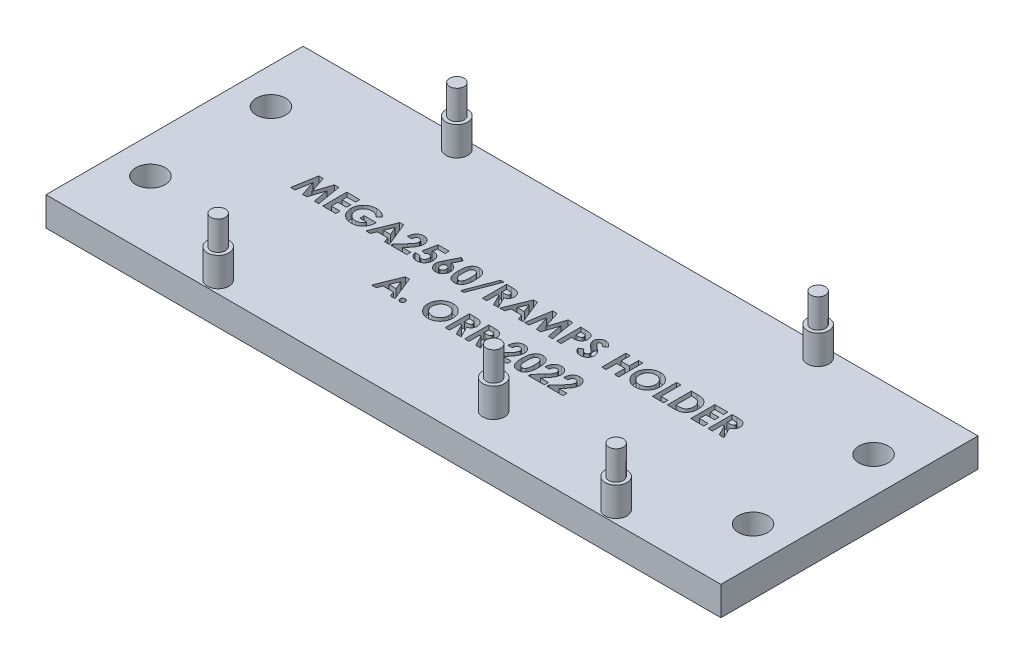
from build123d import *

# Parameters (mm, degrees)
SKETCH1_W           = 140
SKETCH1_H           = 53.34
SKETCH1_R           = 3.05
BOSS_EXTRUDE1_DEPTH = 6
SKETCH2_R           = 2.25
BOSS_EXTRUDE3_DEPTH = 6
SKETCH3_R           = 1.5
BOSS_EXTRUDE4_DEPTH = 6
CUT_EXTRUDE1_DEPTH  = 2


with BuildPart() as part:
    # Sketch1 → Boss-Extrude1 (new body)
    with BuildSketch(Plane(origin=(0, 0, 0), x_dir=(1, 0, 0), z_dir=(0, 1, 0))):
        with Locations((32.854546863, 0.873853211)):
            Rectangle(SKETCH1_W, SKETCH1_H)
        with Locations(Location((-29.645453137, 13.373853211, 0), (0, 0, 270))):
            Circle(SKETCH1_R, mode=Mode.SUBTRACT)
        with Locations(Location((95.354546863, 13.373853211, 0), (0, 0, 270))):
            Circle(SKETCH1_R, mode=Mode.SUBTRACT)
        with Locations(Location((95.354546863, -11.626146789, 0), (0, 0, 270))):
            Circle(SKETCH1_R, mode=Mode.SUBTRACT)
        with Locations(Location((-29.645453137, -11.626146789, 0), (0, 0, 270))):
            Circle(SKETCH1_R, mode=Mode.SUBTRACT)
    extrude(amount=BOSS_EXTRUDE1_DEPTH)

    # Sketch2 → Boss-Extrude3 (add)
    with BuildSketch(Plane(origin=(0, 6, 0), x_dir=(1, 0, 0), z_dir=(0, 1, 0))):
        with Locations(Location((-2.705453137, 25.003853211, 0), (0, 0, 270))):
            Circle(SKETCH2_R)
        with Locations(Location((72.224546863, 25.003853211, 0), (0, 0, 270))):
            Circle(SKETCH2_R)
        with Locations(Location((48.094546863, -18.176146789, 0), (0, 0, 270))):
            Circle(SKETCH2_R)
        with Locations(Location((-3.975453137, -23.256146789, 0), (0, 0, 270))):
            Circle(SKETCH2_R)
        with Locations(Location((78.574546863, -23.256146789, 0), (0, 0, 270))):
            Circle(SKETCH2_R)
    extrude(amount=BOSS_EXTRUDE3_DEPTH)

    # Sketch3 → Boss-Extrude4 (add)
    with BuildSketch(Plane(origin=(0, 12, 0), x_dir=(1, 0, 0), z_dir=(0, 1, 0))):
        with Locations(Location((-2.705453137, 25.003853211, 0), (0, 0, 270))):
            Circle(SKETCH3_R)
        with Locations(Location((-3.975453137, -23.256146789, 0), (0, 0, 270))):
            Circle(SKETCH3_R)
        with Locations(Location((48.094546863, -18.176146789, 0), (0, 0, 270))):
            Circle(SKETCH3_R)
        with Locations(Location((78.574546863, -23.256146789, 0), (0, 0, 270))):
            Circle(SKETCH3_R)
        with Locations(Location((72.224546863, 25.003853211, 0), (0, 0, 270))):
            Circle(SKETCH3_R)
    extrude(amount=BOSS_EXTRUDE4_DEPTH)

    # Sketch4 → Cut-Extrude1 (cut)
    # profile 1 of 29: a face of its own
    with BuildSketch(Plane(origin=(0, 6, 0), x_dir=(1, 0, 0), z_dir=(0, 1, 0))):
        Polygon((-12.230589355, 5.873853211), (-11.29909897, 5.873853211), (-10.158273649, 2.386273083), (-9.009435508, 5.873853211), (-8.086959547, 5.873853211), (-7.241606983, 0.873853211), (-8.150060508, 0.873853211), (-8.683914675, 4.031906096), (-9.723578137, 0.873853211), (-10.598978778, 0.873853211), (-11.632632624, 4.031906096), (-12.165485188, 0.873853211), (-13.074940316, 0.873853211), align=None)
    # profile 2 of 29: a face of its own
    with BuildSketch(Plane(origin=(0, 6, 0), x_dir=(1, 0, 0), z_dir=(0, 1, 0))):
        Polygon((-6.408273649, 5.873853211), (-3.715965957, 5.873853211), (-3.715965957, 4.976417314), (-5.510837752, 4.976417314), (-5.510837752, 4.014878852), (-3.715965957, 4.014878852), (-3.715965957, 3.117442955), (-5.510837752, 3.117442955), (-5.510837752, 1.771289108), (-3.715965957, 1.771289108), (-3.715965957, 0.873853211), (-6.408273649, 0.873853211), align=None)
    # profile 3 of 29: a face of its own
    with BuildSketch(Plane(origin=(0, 6, 0), x_dir=(1, 0, 0), z_dir=(0, 1, 0))):
        with BuildLine():
            Line((1.763801671, 5.078580775), (1.084715133, 4.428540711))
            add(Edge.make_bspline(
                [(1.084715133, 4.428540711), (1.030950666, 4.482369597), (0.925455908, 4.587990757), (0.752932426, 4.725463956), (0.574250459, 4.842343352), (0.388821892, 4.938449767), (0.196388421, 5.012998258), (-0.002670199, 5.066325179), (-0.208677811, 5.097954279), (-0.348135769, 5.102382246), (-0.418690316, 5.104622442)],
                knots=[0, 0, 0, 0, 1.075575784, 2.110457258, 3.113929901, 4.09197124, 5.059417775, 6.02750972, 7.002078037, 8, 8, 8, 8], degree=3))
            add(Edge.make_bspline(
                [(-0.418690316, 5.104622442), (-0.479858952, 5.103052747), (-0.599968929, 5.099970512), (-0.776458974, 5.076564237), (-0.945106023, 5.037465107), (-1.106706834, 4.983299791), (-1.260274778, 4.912813595), (-1.406699657, 4.827094392), (-1.545080371, 4.725486421), (-1.674327271, 4.609915817), (-1.792006989, 4.483736052), (-1.894747597, 4.348679086), (-1.982260523, 4.207262265), (-2.054301509, 4.05876208), (-2.109116865, 3.903406451), (-2.148247857, 3.741308157), (-2.173086306, 3.572938277), (-2.176018984, 3.458074602), (-2.177504419, 3.399894878)],
                knots=[0, 0, 0, 0, 1.075001177, 2.110859044, 3.123021556, 4.114053297, 5.101481495, 6.087880186, 7.091499647, 8.114004866, 9.131394192, 10.11971144, 11.092043119, 12.050101265, 13.015322563, 13.981809771, 14.977764287, 16, 16, 16, 16], degree=3))
            add(Edge.make_bspline(
                [(-2.177504419, 3.399894878), (-2.176118877, 3.339701475), (-2.173389169, 3.221112232), (-2.147167242, 3.047077419), (-2.106767848, 2.879643388), (-2.047633908, 2.720052461), (-1.974857937, 2.566118464), (-1.882566014, 2.420823246), (-1.774944397, 2.28194799), (-1.652185389, 2.151910593), (-1.518655291, 2.032047408), (-1.37403785, 1.928650339), (-1.222733216, 1.839440988), (-1.062299324, 1.768790066), (-0.895520833, 1.712065115), (-0.720706129, 1.672069157), (-0.538248853, 1.647531775), (-0.413759898, 1.644581337), (-0.350581342, 1.64308398)],
                knots=[0, 0, 0, 0, 1.022067601, 2.013613092, 2.983553406, 3.943623673, 4.90013463, 5.87121881, 6.861774014, 7.881098904, 8.905697761, 9.905387765, 10.89678721, 11.884561068, 12.87834324, 13.885584958, 14.926927371, 16, 16, 16, 16], degree=3))
            add(Edge.make_bspline(
                [(-0.350581342, 1.64308398), (-0.30948603, 1.643454776), (-0.228806791, 1.644182731), (-0.110464094, 1.655999485), (0.002879784, 1.672892909), (0.111663794, 1.695257795), (0.214789508, 1.726908123), (0.313684774, 1.763919284), (0.407770152, 1.807599834), (0.496535521, 1.859456833), (0.581301967, 1.91758219), (0.66127606, 1.984089959), (0.737860638, 2.057480634), (0.810160822, 2.138650787), (0.87695291, 2.228326174), (0.940376751, 2.324858891), (0.999706152, 2.429206966), (1.03476233, 2.50289229), (1.052663851, 2.540519878)],
                knots=[0, 0, 0, 0, 1.109579412, 2.178351274, 3.208885622, 4.204702371, 5.174744997, 6.119429583, 7.05542196, 7.97267548, 8.893247984, 9.828544973, 10.778894627, 11.756245826, 12.760884819, 13.796418446, 14.874735809, 16, 16, 16, 16], degree=3))
            Line((1.052663851, 2.540519878), (-0.382632624, 2.540519878))
            Line((-0.382632624, 2.540519878), (-0.382632624, 3.437955775))
            Line((-0.382632624, 3.437955775), (2.110356158, 3.437955775))
            Line((2.110356158, 3.437955775), (2.117367376, 3.224614429))
            add(Edge.make_bspline(
                [(2.117367376, 3.224614429), (2.116466487, 3.169822958), (2.114666316, 3.060337797), (2.098214642, 2.897333043), (2.070962694, 2.736490209), (2.033706672, 2.577970842), (1.987015453, 2.420997347), (1.927469532, 2.267072876), (1.857741623, 2.115153565), (1.779616447, 1.965884953), (1.691826229, 1.822657661), (1.597307168, 1.687040322), (1.497406698, 1.559267662), (1.389952026, 1.441119873), (1.276616397, 1.331604461), (1.157176709, 1.231142746), (1.031210511, 1.139649724), (0.899385094, 1.056352489), (0.760949587, 0.983347378), (0.616665108, 0.919842616), (0.466749506, 0.865909362), (0.310815735, 0.821695826), (0.149170633, 0.787581566), (-0.018189262, 0.764189374), (-0.191355867, 0.748294116), (-0.308811112, 0.746540757), (-0.368610188, 0.745648083)],
                knots=[0, 0, 0, 0, 1.006889344, 2.011981806, 3.007738725, 4.003571281, 5.003404394, 6.015442001, 7.03424805, 8.074616296, 9.110249922, 10.119753985, 11.111721717, 12.089233633, 13.052717867, 14.006597561, 14.955430184, 15.912305663, 16.870361111, 17.829300583, 18.807640451, 19.796414044, 20.806216501, 21.841577364, 22.90109906, 24, 24, 24, 24], degree=3))
            add(Edge.make_bspline(
                [(-0.368610188, 0.745648083), (-0.432411748, 0.746529615), (-0.558885469, 0.748277075), (-0.745893816, 0.764643223), (-0.927476934, 0.791654494), (-1.103680115, 0.829037171), (-1.274912467, 0.875562898), (-1.440879786, 0.933963691), (-1.601242625, 1.003433281), (-1.756481194, 1.082132086), (-1.904611376, 1.171383387), (-2.045301187, 1.269622151), (-2.177782716, 1.377480302), (-2.303412983, 1.493152274), (-2.419256781, 1.619481292), (-2.529631155, 1.752372421), (-2.629188845, 1.896699578), (-2.722210535, 2.047783634), (-2.804851747, 2.205561276), (-2.877122676, 2.367114326), (-2.938755282, 2.53150739), (-2.987354083, 2.699505938), (-3.026811757, 2.869938544), (-3.055044463, 3.043546379), (-3.070988792, 3.220307711), (-3.073617294, 3.339100483), (-3.074940316, 3.398893275)],
                knots=[0, 0, 0, 0, 1.084149091, 2.14910686, 3.187506334, 4.202448172, 5.208724393, 6.201130722, 7.189831603, 8.176984443, 9.156919086, 10.126598231, 11.090766514, 12.05840148, 13.026036446, 14.001772938, 14.991905635, 16.003017641, 17.015720547, 18.016462227, 19.009322657, 19.99686681, 20.986544154, 21.980959929, 22.983742515, 24, 24, 24, 24], degree=3))
            add(Edge.make_bspline(
                [(-3.074940316, 3.398893275), (-3.073168507, 3.480463421), (-3.069669709, 3.641540275), (-3.03726553, 3.878807504), (-2.986752243, 4.108339873), (-2.914260591, 4.329301442), (-2.821236682, 4.541996586), (-2.708998285, 4.74692462), (-2.575107339, 4.943867721), (-2.47146655, 5.065802854), (-2.418890637, 5.127659301)],
                knots=[0, 0, 0, 0, 1.034044851, 2.041932006, 3.031217818, 4.011390712, 4.986069675, 5.97149666, 6.970960976, 8, 8, 8, 8], degree=3))
            add(Edge.make_bspline(
                [(-2.418890637, 5.127659301), (-2.386246766, 5.16344513), (-2.321449173, 5.234479464), (-2.217870339, 5.333183115), (-2.111664716, 5.425968199), (-2.001361341, 5.510867266), (-1.887540056, 5.589738798), (-1.769873266, 5.661104284), (-1.648978222, 5.72723604), (-1.523912089, 5.784757127), (-1.395329607, 5.83632958), (-1.262661303, 5.879967126), (-1.126900835, 5.91861962), (-0.986846041, 5.948024255), (-0.843911808, 5.97251019), (-0.697083541, 5.988921947), (-0.546761355, 6.000950596), (-0.445090989, 6.001686171), (-0.393650252, 6.002058339)],
                knots=[0, 0, 0, 0, 1.020590567, 2.025856924, 3.013483481, 3.991664875, 4.957826714, 5.930500614, 6.890802512, 7.860442893, 8.829981142, 9.809047939, 10.802672283, 11.803273349, 12.823572789, 13.857849586, 14.916166035, 16, 16, 16, 16], degree=3))
            add(Edge.make_bspline(
                [(-0.393650252, 6.002058339), (-0.339877981, 6.001229078), (-0.232890906, 5.999579154), (-0.073818843, 5.988162751), (0.083042807, 5.970549934), (0.237033014, 5.944129701), (0.388668569, 5.911548055), (0.537164571, 5.869802903), (0.683489772, 5.822372891), (0.778746924, 5.784558181), (0.826301671, 5.765680134)],
                knots=[0, 0, 0, 0, 1.03180557, 2.052914215, 3.058998889, 4.059601663, 5.049854447, 6.033765722, 7.018406786, 8, 8, 8, 8], degree=3))
            add(Edge.make_bspline(
                [(0.826301671, 5.765680134), (0.866313108, 5.748233421), (0.947695265, 5.712747289), (1.066096271, 5.647823746), (1.184786564, 5.575848547), (1.302485415, 5.494190112), (1.419013483, 5.40300118), (1.535587445, 5.303722065), (1.651017273, 5.195195115), (1.725719993, 5.117955634), (1.763801671, 5.078580775)],
                knots=[0, 0, 0, 0, 0.894392155, 1.819168899, 2.76525314, 3.739198753, 4.75366411, 5.797420238, 6.877176959, 8, 8, 8, 8], degree=3))
        make_face()
    # profile 4 of 29: a face of its own
    with BuildSketch(Plane(origin=(0, 6, 0), x_dir=(1, 0, 0), z_dir=(0, 1, 0))):
        Polygon((4.554266415, 5.873853211), (5.386598145, 5.873853211), (7.405828915, 0.873853211), (6.447295261, 0.873853211), (6.058673466, 1.899494237), (3.880187889, 1.899494237), (3.491566094, 0.873853211), (2.534034043, 0.873853211), align=None)
        Polygon((4.969931479, 4.532707378), (4.220732761, 2.796930134), (5.719130197, 2.796930134), align=None, mode=Mode.SUBTRACT)
    # profile 5 of 29: a face of its own
    with BuildSketch(Plane(origin=(0, 6, 0), x_dir=(1, 0, 0), z_dir=(0, 1, 0))):
        with BuildLine():
            Line((8.719931479, 4.207186544), (7.822495581, 4.207186544))
            add(Edge.make_bspline(
                [(7.822495581, 4.207186544), (7.826371469, 4.275072822), (7.833944722, 4.407718533), (7.864069206, 4.600390676), (7.904434981, 4.782444663), (7.958308466, 4.953243651), (8.026004025, 5.112725577), (8.105779677, 5.261434122), (8.199673509, 5.398586334), (8.30568715, 5.523520787), (8.422020782, 5.635600638), (8.546259203, 5.734977675), (8.680302808, 5.816981104), (8.821702509, 5.884462335), (8.970434231, 5.938376703), (9.127905209, 5.97442282), (9.292751973, 5.998833604), (9.405602931, 6.000969646), (9.463120581, 6.002058339)],
                knots=[0, 0, 0, 0, 1.199038563, 2.342849363, 3.436047546, 4.486744587, 5.497670872, 6.488682221, 7.459191391, 8.424610317, 9.374430501, 10.305433194, 11.225809216, 12.140057399, 13.06607119, 14.010487599, 14.985989317, 16, 16, 16, 16], degree=3))
            add(Edge.make_bspline(
                [(9.463120581, 6.002058339), (9.533722681, 5.999855368), (9.671554524, 5.995554651), (9.871835125, 5.958868109), (10.058875308, 5.897504198), (10.232539113, 5.811762631), (10.39134811, 5.702836958), (10.535275962, 5.57296092), (10.659970063, 5.41940965), (10.76622101, 5.248572165), (10.854502849, 5.067679311), (10.916367083, 4.8806286), (10.957029779, 4.692383597), (10.961366707, 4.56562894), (10.963521222, 4.502659301)],
                knots=[0, 0, 0, 0, 1.075374347, 2.099382735, 3.09057751, 4.06680945, 5.040638231, 6.016817125, 7.011024321, 8.044445721, 9.0776792, 10.070479129, 11.0414456, 12, 12, 12, 12], degree=3))
            add(Edge.make_bspline(
                [(10.963521222, 4.502659301), (10.962682368, 4.464570812), (10.960993961, 4.387908093), (10.949254246, 4.271898584), (10.931642353, 4.153729335), (10.905087911, 4.033501666), (10.871972344, 3.911181876), (10.831798376, 3.786403902), (10.78363413, 3.659875191), (10.728283371, 3.530171684), (10.662249775, 3.396872284), (10.585362831, 3.257978781), (10.495581786, 3.113614384), (10.393991081, 2.962963966), (10.280097314, 2.806265125), (10.153344494, 2.643989887), (10.015192516, 2.475566446), (9.917142171, 2.362984828), (9.866766415, 2.305143275)],
                knots=[0, 0, 0, 0, 0.728284026, 1.46585585, 2.227944881, 3.01186502, 3.81876927, 4.650621989, 5.517437689, 6.406905708, 7.346299482, 8.360816762, 9.441613733, 10.596154504, 11.834900912, 13.145207542, 14.533280747, 16, 16, 16, 16], degree=3))
            Line((9.866766415, 2.305143275), (9.344931479, 1.707186544))
            Line((9.344931479, 1.707186544), (11.027623786, 1.707186544))
            Line((11.027623786, 1.707186544), (11.027623786, 0.873853211))
            Line((11.027623786, 0.873853211), (7.694290453, 0.873853211))
            Line((7.694290453, 0.873853211), (7.694290453, 1.328580775))
            Line((7.694290453, 1.328580775), (9.174659043, 2.904101608))
            add(Edge.make_bspline(
                [(9.174659043, 2.904101608), (9.217519518, 2.95006004), (9.300527547, 3.039067894), (9.418639419, 3.169785396), (9.525520229, 3.293833185), (9.618953717, 3.412532121), (9.703843153, 3.522032091), (9.776403323, 3.625633563), (9.837298096, 3.722399942), (9.903408009, 3.839083295), (9.966190695, 3.978248956), (10.023797609, 4.138573505), (10.058913009, 4.291806849), (10.063760045, 4.391656991), (10.066085325, 4.439558339)],
                knots=[0, 0, 0, 0, 1.246127091, 2.413378631, 3.493388633, 4.492180848, 5.408488754, 6.240484944, 6.999099869, 7.674939598, 8.898438119, 10.020720584, 11.050475521, 12, 12, 12, 12], degree=3))
            add(Edge.make_bspline(
                [(10.066085325, 4.439558339), (10.064346769, 4.485899198), (10.060978039, 4.575692043), (10.02395842, 4.703421886), (9.966606342, 4.81906822), (9.885789165, 4.919175402), (9.787894251, 5.001440112), (9.674767483, 5.062626292), (9.547331176, 5.097930437), (9.457995897, 5.102349255), (9.412038851, 5.104622442)],
                knots=[0, 0, 0, 0, 1.062038974, 2.057870785, 3.028805853, 4.01125022, 4.991535629, 5.949134679, 6.94496649, 8, 8, 8, 8], degree=3))
            add(Edge.make_bspline(
                [(9.412038851, 5.104622442), (9.388296855, 5.103782699), (9.341556924, 5.102129531), (9.272852878, 5.091124838), (9.207476043, 5.071730216), (9.144698737, 5.045744151), (9.085190937, 5.011299436), (9.029102739, 4.968840837), (8.975843185, 4.919447324), (8.925656544, 4.863273343), (8.879980149, 4.800583164), (8.839410542, 4.731949333), (8.80586623, 4.657414454), (8.776332599, 4.5779625), (8.75355485, 4.492740093), (8.736969823, 4.402257279), (8.724361334, 4.306661263), (8.72143496, 4.240947991), (8.719931479, 4.207186544)],
                knots=[0, 0, 0, 0, 0.903469896, 1.778625579, 2.63899355, 3.493148037, 4.358286772, 5.247621495, 6.164656832, 7.118446693, 8.109501108, 9.111810964, 10.146451449, 11.215617525, 12.33435995, 13.498009769, 14.714554818, 16, 16, 16, 16], degree=3))
        make_face()
    # profile 6 of 29: a face of its own
    with BuildSketch(Plane(origin=(0, 6, 0), x_dir=(1, 0, 0), z_dir=(0, 1, 0))):
        with BuildLine():
            Line((12.53303244, 5.873853211), (14.809675069, 5.873853211))
            Line((14.809675069, 5.873853211), (14.809675069, 5.040519878))
            Line((14.809675069, 5.040519878), (13.244170261, 5.040519878))
            Line((13.244170261, 5.040519878), (13.048857761, 4.095007057))
            add(Edge.make_bspline(
                [(13.048857761, 4.095007057), (13.075471885, 4.102419427), (13.127960405, 4.117038142), (13.207034427, 4.131698864), (13.283668173, 4.141201478), (13.33395477, 4.142469001), (13.358352953, 4.14308398)],
                knots=[0, 0, 0, 0, 1.05461699, 2.079921384, 3.068411212, 4, 4, 4, 4], degree=3))
            add(Edge.make_bspline(
                [(13.358352953, 4.14308398), (13.41151915, 4.141865708), (13.516321436, 4.139464224), (13.669633882, 4.116666311), (13.816439605, 4.080760289), (13.956289365, 4.029550893), (14.089046547, 3.962900542), (14.214872078, 3.882272301), (14.333920388, 3.787524556), (14.444076678, 3.67859799), (14.545292879, 3.558994153), (14.633294593, 3.429629948), (14.708453548, 3.292349982), (14.768232383, 3.146300927), (14.815414936, 2.992400068), (14.849510102, 2.830548782), (14.869672277, 2.66055525), (14.872391023, 2.544580817), (14.873777633, 2.485431737)],
                knots=[0, 0, 0, 0, 1.01440847, 1.999622559, 2.951875003, 3.895578053, 4.836219714, 5.782137149, 6.743708247, 7.735272588, 8.734977101, 9.730283169, 10.717124674, 11.717316708, 12.737475749, 13.78628267, 14.87096371, 16, 16, 16, 16], degree=3))
            add(Edge.make_bspline(
                [(14.873777633, 2.485431737), (14.872083173, 2.425611178), (14.868739509, 2.307567728), (14.846925163, 2.134002103), (14.808422452, 1.967765416), (14.755535125, 1.808412658), (14.685859457, 1.657115031), (14.602064931, 1.512305207), (14.502734807, 1.375058061), (14.388843854, 1.246780544), (14.265029447, 1.12953243), (14.133196332, 1.02638904), (13.994270676, 0.939594713), (13.848249125, 0.869450223), (13.695969453, 0.813953152), (13.53738544, 0.773553933), (13.371726389, 0.750387225), (13.259265418, 0.747245156), (13.202102953, 0.745648083)],
                knots=[0, 0, 0, 0, 1.06808661, 2.107647099, 3.116961351, 4.110378221, 5.100014249, 6.085620622, 7.093190682, 8.119403071, 9.144090782, 10.133780668, 11.103064255, 12.062861538, 13.020824475, 13.992378307, 14.979551724, 16, 16, 16, 16], degree=3))
            add(Edge.make_bspline(
                [(13.202102953, 0.745648083), (13.150984262, 0.746954588), (13.050167506, 0.74953129), (12.901668851, 0.765369058), (12.758499657, 0.79337038), (12.621419996, 0.833895543), (12.488987561, 0.883772767), (12.362733308, 0.946153662), (12.241963449, 1.019850411), (12.127020925, 1.103518048), (12.019773389, 1.197766395), (11.921889202, 1.300937449), (11.83277576, 1.41173079), (11.754339953, 1.53151327), (11.686827653, 1.660107919), (11.626956367, 1.795999217), (11.577951121, 1.940606305), (11.553082369, 2.040855972), (11.540444299, 2.091801929)],
                knots=[0, 0, 0, 0, 1.054957082, 2.080596141, 3.077793124, 4.061112343, 5.027190972, 5.994718051, 6.962465889, 7.943658696, 8.924948258, 9.904494768, 10.875059, 11.855380583, 12.854004648, 13.869083016, 14.917087635, 16, 16, 16, 16], degree=3))
            Line((11.540444299, 2.091801929), (12.566085325, 2.091801929))
            add(Edge.make_bspline(
                [(12.566085325, 2.091801929), (12.584834068, 2.056498456), (12.621270109, 1.987890184), (12.690579516, 1.896802394), (12.768166997, 1.819126641), (12.85333267, 1.754104014), (12.946628357, 1.705390169), (13.044252433, 1.668447842), (13.14743131, 1.64710024), (13.217700681, 1.644431578), (13.253184684, 1.64308398)],
                knots=[0, 0, 0, 0, 1.104910296, 2.147267069, 3.153527244, 4.136738762, 5.099945312, 6.05603338, 7.018353, 8, 8, 8, 8], degree=3))
            add(Edge.make_bspline(
                [(13.253184684, 1.64308398), (13.277916558, 1.644014508), (13.326576936, 1.645845337), (13.39827031, 1.65553088), (13.466704784, 1.673875081), (13.532389154, 1.699277533), (13.595499864, 1.730957261), (13.6551322, 1.770950853), (13.712323657, 1.816984961), (13.766203551, 1.869809255), (13.815003204, 1.928696056), (13.857795161, 1.991973938), (13.896057073, 2.058236853), (13.924398255, 2.130109641), (13.947607287, 2.205446155), (13.964699358, 2.284814682), (13.974913797, 2.368307917), (13.975859381, 2.425306409), (13.976341735, 2.454382057)],
                knots=[0, 0, 0, 0, 0.978869489, 1.925942215, 2.855067702, 3.774946051, 4.70828698, 5.642468714, 6.60995405, 7.609372294, 8.622401667, 9.629904756, 10.629323, 11.642352373, 12.678539694, 13.745912462, 14.850161547, 16, 16, 16, 16], degree=3))
            add(Edge.make_bspline(
                [(13.976341735, 2.454382057), (13.975781907, 2.482782794), (13.974692189, 2.538065518), (13.965677819, 2.619240358), (13.949551285, 2.696260591), (13.927578745, 2.769716133), (13.899451269, 2.839160928), (13.865077614, 2.905008345), (13.824310932, 2.966925548), (13.776932355, 3.023651964), (13.726408327, 3.075683046), (13.672129287, 3.121189015), (13.614584259, 3.158955811), (13.555561384, 3.191927322), (13.492704682, 3.215923269), (13.427427548, 3.232448392), (13.359798628, 3.244573863), (13.313670409, 3.245286279), (13.290243979, 3.245648083)],
                knots=[0, 0, 0, 0, 1.166249705, 2.270133367, 3.348514167, 4.393962215, 5.415026464, 6.420877785, 7.440098956, 8.453121383, 9.451844239, 10.415694839, 11.355045125, 12.27538808, 13.187007209, 14.108269027, 15.039275622, 16, 16, 16, 16], degree=3))
            add(Edge.make_bspline(
                [(13.290243979, 3.245648083), (13.264797431, 3.244682528), (13.213797089, 3.242747348), (13.138023346, 3.227001308), (13.063163224, 3.201518309), (12.988800423, 3.166360473), (12.915673124, 3.12034996), (12.841851459, 3.066384902), (12.769806401, 3.000544228), (12.723998148, 2.951505944), (12.700300069, 2.926136865)],
                knots=[0, 0, 0, 0, 0.88288272, 1.769486374, 2.674910571, 3.623812639, 4.617874466, 5.670434592, 6.794841017, 8, 8, 8, 8], degree=3))
            Line((12.700300069, 2.926136865), (11.945091735, 3.099414108))
            Line((11.945091735, 3.099414108), (12.53303244, 5.873853211))
        make_face()
    # profile 7 of 29: a face of its own
    with BuildSketch(Plane(origin=(0, 6, 0), x_dir=(1, 0, 0), z_dir=(0, 1, 0))):
        with BuildLine():
            Line((17.225540453, 6.002058339), (18.019811286, 5.599414108))
            Line((18.019811286, 5.599414108), (17.148417056, 3.886673724))
            add(Edge.make_bspline(
                [(17.148417056, 3.886673724), (17.199898209, 3.885340851), (17.301298784, 3.882715539), (17.450489154, 3.861497328), (17.593117925, 3.82481613), (17.730623216, 3.7761953), (17.861324156, 3.710897044), (17.987325756, 3.633221361), (18.105368291, 3.538487511), (18.218158375, 3.433527431), (18.320717819, 3.317246747), (18.409808828, 3.192299458), (18.487450069, 3.061725548), (18.547805246, 2.92260376), (18.596489741, 2.777240197), (18.631617747, 2.625053777), (18.651659257, 2.465603804), (18.654422313, 2.357282214), (18.655828915, 2.302138467)],
                knots=[0, 0, 0, 0, 1.013260694, 1.995783107, 2.958651975, 3.908806537, 4.861209129, 5.829647963, 6.817170299, 7.835534541, 8.860094905, 9.863329007, 10.853101798, 11.844815043, 12.84250023, 13.867713965, 14.914507806, 16, 16, 16, 16], degree=3))
            add(Edge.make_bspline(
                [(18.655828915, 2.302138467), (18.654510813, 2.248983241), (18.651905491, 2.143918152), (18.630369055, 1.989604257), (18.595565044, 1.8415491), (18.545823124, 1.700048364), (18.48259712, 1.56441039), (18.405275999, 1.434714772), (18.313218534, 1.311930682), (18.208803234, 1.196710536), (18.094659299, 1.091686521), (17.974345374, 0.998335064), (17.846841935, 0.92122322), (17.714558945, 0.856100459), (17.575060994, 0.807504772), (17.430435675, 0.770823446), (17.279586253, 0.749656729), (17.17719353, 0.746994991), (17.125380197, 0.745648083)],
                knots=[0, 0, 0, 0, 1.049934834, 2.075270938, 3.072134561, 4.05064612, 5.033440221, 6.024524368, 7.028587226, 8.060776465, 9.092543989, 10.090062252, 11.064205434, 12.031961459, 12.998029633, 13.977230324, 14.976426867, 16, 16, 16, 16], degree=3))
            add(Edge.make_bspline(
                [(17.125380197, 0.745648083), (17.071199195, 0.746753419), (16.964659587, 0.748926912), (16.808765476, 0.773264307), (16.659249606, 0.809900862), (16.516952282, 0.862211639), (16.380988598, 0.92881949), (16.252959281, 1.011240007), (16.131785862, 1.108564312), (16.018760226, 1.218602762), (15.916932551, 1.339134827), (15.826110776, 1.464278493), (15.749275437, 1.594230136), (15.687079022, 1.728850814), (15.638551935, 1.867711552), (15.604786981, 2.011075897), (15.582785997, 2.158563574), (15.580206884, 2.258657057), (15.578905838, 2.309149685)],
                knots=[0, 0, 0, 0, 1.063775006, 2.091769615, 3.092589432, 4.084662827, 5.064601646, 6.061867366, 7.070035304, 8.113879863, 9.156342271, 10.166834137, 11.149076039, 12.117706134, 13.076241869, 14.034148791, 15.008317125, 16, 16, 16, 16], degree=3))
            add(Edge.make_bspline(
                [(15.578905838, 2.309149685), (15.579593285, 2.348250319), (15.580972006, 2.426669236), (15.594827326, 2.544097304), (15.615892279, 2.661833608), (15.640309317, 2.761183231), (15.665451517, 2.845193733), (15.690757334, 2.916289552), (15.722118318, 2.995190364), (15.757968569, 3.082097652), (15.799435446, 3.176906865), (15.846302333, 3.279359579), (15.898685908, 3.390231643), (15.936042612, 3.466383582), (15.955508402, 3.506064749)],
                knots=[0, 0, 0, 0, 1.110454016, 2.227089276, 3.35462975, 4.507227546, 5.131400587, 5.845402449, 6.650387134, 7.543487832, 8.516250726, 9.590168902, 10.744287919, 12, 12, 12, 12], degree=3))
            Line((15.955508402, 3.506064749), (17.225540453, 6.002058339))
        make_face()
        with BuildLine():
            add(Edge.make_bspline(
                [(17.105348145, 3.05334039), (17.06228644, 3.051365241), (16.978020334, 3.047500133), (16.858206534, 3.007022838), (16.748963532, 2.943524036), (16.654270347, 2.855089675), (16.575068211, 2.749407141), (16.516867702, 2.628862094), (16.481856862, 2.495063175), (16.47821946, 2.401513202), (16.476341735, 2.353220198)],
                knots=[0, 0, 0, 0, 0.981744412, 1.921144944, 2.858899012, 3.85339082, 4.86292663, 5.863643845, 6.897155691, 8, 8, 8, 8], degree=3))
            add(Edge.make_bspline(
                [(16.476341735, 2.353220198), (16.47856502, 2.304911113), (16.482889457, 2.210946712), (16.519216751, 2.075873789), (16.578695803, 1.952591304), (16.66211138, 1.845508246), (16.76004007, 1.756621018), (16.868631371, 1.690884663), (16.986073942, 1.650500662), (17.067311836, 1.645573278), (17.108352953, 1.64308398)],
                knots=[0, 0, 0, 0, 1.098279937, 2.136227893, 3.159405121, 4.194678092, 5.206500211, 6.154139736, 7.067477469, 8, 8, 8, 8], degree=3))
            add(Edge.make_bspline(
                [(17.108352953, 1.64308398), (17.151697011, 1.645617615), (17.236702238, 1.650586511), (17.359327852, 1.689271227), (17.471347086, 1.753906283), (17.570393757, 1.842508931), (17.655472966, 1.948370027), (17.714339184, 2.072376656), (17.752345905, 2.208424488), (17.756332119, 2.303872816), (17.758393017, 2.353220198)],
                knots=[0, 0, 0, 0, 0.96921794, 1.900804717, 2.848419905, 3.844199796, 4.861108892, 5.867439427, 6.897452859, 8, 8, 8, 8], degree=3))
            add(Edge.make_bspline(
                [(17.758393017, 2.353220198), (17.756045278, 2.401485004), (17.751498607, 2.494955437), (17.717347721, 2.629381173), (17.656373619, 2.749461594), (17.57537947, 2.855525916), (17.477427448, 2.943920844), (17.363812319, 3.007523609), (17.238525224, 3.04742842), (17.150387749, 3.051341001), (17.105348145, 3.05334039)],
                knots=[0, 0, 0, 0, 1.083229974, 2.097801324, 3.086792542, 4.086858909, 5.079819718, 6.026392613, 6.991456328, 8, 8, 8, 8], degree=3))
        make_face(mode=Mode.SUBTRACT)
    # profile 8 of 29: a face of its own
    with BuildSketch(Plane(origin=(0, 6, 0), x_dir=(1, 0, 0), z_dir=(0, 1, 0))):
        with BuildLine():
            add(Edge.make_bspline(
                [(20.980548466, 6.002058339), (21.023988088, 6.001413466), (21.109401992, 6.000145472), (21.235200594, 5.98641207), (21.356379429, 5.96566473), (21.473412563, 5.936729424), (21.585457581, 5.898434579), (21.693329968, 5.852596305), (21.795745732, 5.79681029), (21.894011, 5.733797122), (21.988087921, 5.662457283), (22.075715422, 5.581126183), (22.158493767, 5.491675254), (22.234631109, 5.392752158), (22.305813534, 5.285256707), (22.371807148, 5.169171853), (22.432106753, 5.043929441), (22.487388165, 4.90930346), (22.536820978, 4.763275924), (22.578458174, 4.604171835), (22.614169038, 4.431954858), (22.644311526, 4.24619632), (22.667094376, 4.046649302), (22.682450475, 3.833446374), (22.692988557, 3.60699856), (22.693848602, 3.45165722), (22.694290453, 3.371850006)],
                knots=[0, 0, 0, 0, 0.879237366, 1.728815576, 2.559023295, 3.367336655, 4.166867292, 4.954216142, 5.737608147, 6.525189134, 7.316157332, 8.124696809, 8.942788509, 9.781158001, 10.649253743, 11.551476218, 12.482711956, 13.461909668, 14.496590415, 15.601789533, 16.789733467, 18.056700938, 19.410929216, 20.8549011, 22.384193279, 24, 24, 24, 24], degree=3))
            add(Edge.make_bspline(
                [(22.694290453, 3.371850006), (22.693812931, 3.291044314), (22.692885115, 3.134040304), (22.682888546, 2.905521283), (22.665673982, 2.690770374), (22.64348661, 2.489809794), (22.61309598, 2.302745667), (22.577504327, 2.129093624), (22.5352099, 1.968916608), (22.484148786, 1.822575532), (22.429201994, 1.687713118), (22.368737444, 1.562714899), (22.303809023, 1.447242309), (22.235905994, 1.339553289), (22.161305664, 1.242822456), (22.08363904, 1.153760455), (21.999524379, 1.075759773), (21.912503234, 1.004800604), (21.819387667, 0.943477642), (21.721137956, 0.88984559), (21.616002479, 0.846343627), (21.505897676, 0.808507942), (21.388946789, 0.781346003), (21.267008152, 0.759793897), (21.138705101, 0.747882881), (21.051351216, 0.746405242), (21.006590133, 0.745648083)],
                knots=[0, 0, 0, 0, 1.643780988, 3.193836972, 4.651895693, 6.025988579, 7.305620092, 8.505800249, 9.631074763, 10.672816429, 11.65661981, 12.592235626, 13.49536222, 14.350718032, 15.179365177, 15.97804903, 16.751647189, 17.51006938, 18.259804725, 19.016521909, 19.783502495, 20.571750527, 21.382245291, 22.22305063, 23.089471752, 24, 24, 24, 24], degree=3))
            add(Edge.make_bspline(
                [(21.006590133, 0.745648083), (20.961830257, 0.746419847), (20.874146319, 0.747931721), (20.745496324, 0.759705334), (20.622911473, 0.781433311), (20.505035316, 0.808716472), (20.392688254, 0.846259912), (20.285331585, 0.891063423), (20.18379079, 0.944360837), (20.087784717, 1.005826676), (19.997641159, 1.076311074), (19.911959285, 1.155060123), (19.83092863, 1.241874212), (19.755781869, 1.337725733), (19.685288316, 1.441335266), (19.620183109, 1.553885984), (19.560505372, 1.675214013), (19.504388377, 1.805488474), (19.455629811, 1.947514026), (19.412236951, 2.102558938), (19.376690661, 2.27191564), (19.348101957, 2.455529721), (19.325276752, 2.653012189), (19.308297423, 2.864458363), (19.298245328, 3.089966728), (19.297327241, 3.24496986), (19.296854556, 3.324774685)],
                knots=[0, 0, 0, 0, 0.917216111, 1.796812873, 2.643793957, 3.46689424, 4.273913431, 5.068098542, 5.848489301, 6.620921603, 7.401012384, 8.190319798, 9.003608147, 9.831726257, 10.68377682, 11.569763213, 12.493818149, 13.453288342, 14.474581811, 15.568529029, 16.750744269, 18.018426408, 19.375425659, 20.823733699, 22.36466933, 24, 24, 24, 24], degree=3))
            add(Edge.make_bspline(
                [(19.296854556, 3.324774685), (19.297710781, 3.435657207), (19.299362879, 3.649606461), (19.32029948, 3.958700928), (19.351029099, 4.24440522), (19.396163631, 4.506241423), (19.451971855, 4.745179304), (19.523437192, 4.959644863), (19.60479528, 5.152605714), (19.674122822, 5.266916883), (19.707511607, 5.321970198)],
                knots=[0, 0, 0, 0, 1.288568992, 2.486310467, 3.599230591, 4.627010532, 5.572937695, 6.447898582, 7.252493626, 8, 8, 8, 8], degree=3))
            add(Edge.make_bspline(
                [(19.707511607, 5.321970198), (19.746334495, 5.376054557), (19.822240892, 5.481800137), (19.954965349, 5.620624317), (20.097560498, 5.739353553), (20.252955161, 5.835300897), (20.418691707, 5.91096498), (20.596193069, 5.96440567), (20.784803764, 5.995542706), (20.914325875, 5.999854029), (20.980548466, 6.002058339)],
                knots=[0, 0, 0, 0, 1.058512271, 2.069600068, 3.047294572, 4.004278952, 4.967380941, 5.939006123, 6.946246673, 8, 8, 8, 8], degree=3))
        make_face()
        with BuildLine():
            add(Edge.make_bspline(
                [(21.002583722, 5.104622442), (20.963313944, 5.102761132), (20.886324332, 5.099111978), (20.774608736, 5.068135804), (20.669267905, 5.020291434), (20.589137949, 4.962718215), (20.529161473, 4.90752738), (20.487255479, 4.857581469), (20.446843753, 4.801845433), (20.411150082, 4.737804189), (20.377445939, 4.667758817), (20.344506832, 4.591391351), (20.317505413, 4.506826041), (20.290977235, 4.415503047), (20.267736076, 4.314897529), (20.24826508, 4.204187148), (20.230869456, 4.082651945), (20.218735801, 3.950212314), (20.207423594, 3.807006819), (20.199314468, 3.652716455), (20.195924246, 3.487382845), (20.194846597, 3.373520041), (20.194290453, 3.31475866)],
                knots=[0, 0, 0, 0, 1.076674018, 2.110852608, 3.161083442, 4.239746716, 4.804137807, 5.395870207, 6.026861976, 6.692161227, 7.405688833, 8.16177676, 8.973626916, 9.841385931, 10.773283133, 11.807421078, 12.927755683, 14.143907515, 15.458935494, 16.872852025, 18.386167141, 20, 20, 20, 20], degree=3))
            add(Edge.make_bspline(
                [(20.194290453, 3.31475866), (20.195205799, 3.23863045), (20.196961041, 3.092648963), (20.206154183, 2.882722502), (20.224581072, 2.691672518), (20.247500402, 2.518204196), (20.279691537, 2.363442523), (20.316729522, 2.225923311), (20.362468139, 2.107399597), (20.415327925, 2.006157259), (20.473872519, 1.920030613), (20.537425252, 1.846822576), (20.60382238, 1.783427869), (20.675136373, 1.731933131), (20.751197099, 1.692469937), (20.831369589, 1.664084549), (20.915704792, 1.646708671), (20.973456669, 1.644299195), (21.002583722, 1.64308398)],
                knots=[0, 0, 0, 0, 1.771748488, 3.397459088, 4.888034009, 6.237357457, 7.467047327, 8.564189669, 9.548206622, 10.417051504, 11.216568818, 11.965764335, 12.669334354, 13.348544111, 14.005342236, 14.656555988, 15.322436492, 16, 16, 16, 16], degree=3))
            add(Edge.make_bspline(
                [(21.002583722, 1.64308398), (21.030711227, 1.64391552), (21.085781384, 1.645543573), (21.166086006, 1.662255309), (21.242027763, 1.689424964), (21.313377363, 1.727858347), (21.380390013, 1.776732274), (21.442738197, 1.836261519), (21.499951698, 1.907039448), (21.533284543, 1.959567139), (21.550460325, 1.98663366)],
                knots=[0, 0, 0, 0, 0.992283464, 1.942767638, 2.88273346, 3.832339453, 4.79467288, 5.803907806, 6.868395428, 8, 8, 8, 8], degree=3))
            add(Edge.make_bspline(
                [(21.550460325, 1.98663366), (21.570681915, 2.023619196), (21.61308495, 2.101174865), (21.662153815, 2.232047165), (21.70345725, 2.379649489), (21.739006513, 2.544441189), (21.763320041, 2.727072225), (21.784258821, 2.926384518), (21.794358115, 3.143381722), (21.79600082, 3.293718169), (21.796854556, 3.371850006)],
                knots=[0, 0, 0, 0, 0.710965849, 1.490837728, 2.352621235, 3.297892224, 4.334225155, 5.461620853, 6.680770821, 8, 8, 8, 8], degree=3))
            add(Edge.make_bspline(
                [(21.796854556, 3.371850006), (21.796524776, 3.450660065), (21.795890007, 3.602355976), (21.784243825, 3.820133301), (21.768025628, 4.019036744), (21.744303087, 4.198622234), (21.713779726, 4.359325727), (21.676159569, 4.501136717), (21.631808203, 4.624334686), (21.579212767, 4.728796789), (21.520960054, 4.817575247), (21.459123022, 4.893740278), (21.393440197, 4.95876806), (21.324021423, 5.012903303), (21.249259977, 5.054266689), (21.170583902, 5.083472662), (21.087831905, 5.101141296), (21.031383328, 5.103446398), (21.002583722, 5.104622442)],
                knots=[0, 0, 0, 0, 1.793836731, 3.452829483, 4.963243077, 6.335886805, 7.574563692, 8.684454726, 9.672768357, 10.54971625, 11.340229787, 12.085688095, 12.778991901, 13.440269426, 14.083255152, 14.715733572, 15.344777694, 16, 16, 16, 16], degree=3))
        make_face(mode=Mode.SUBTRACT)
    # profile 9 of 29: a face of its own
    with BuildSketch(Plane(origin=(0, 6, 0), x_dir=(1, 0, 0), z_dir=(0, 1, 0))):
        Polygon((23.078905838, -0.023582686), (25.379586927, 6.002058339), (26.059675069, 6.002058339), (23.758993979, -0.023582686), align=None)
    # profile 10 of 29: a face of its own
    with BuildSketch(Plane(origin=(0, 6, 0), x_dir=(1, 0, 0), z_dir=(0, 1, 0))):
        with BuildLine():
            Line((26.732751992, 5.873853211), (27.778425069, 5.873853211))
            add(Edge.make_bspline(
                [(27.778425069, 5.873853211), (27.847543741, 5.873607879), (27.980478417, 5.873136038), (28.172162959, 5.865691624), (28.348251572, 5.855332111), (28.509004971, 5.839523219), (28.654354382, 5.81856254), (28.784445481, 5.793853367), (28.899274464, 5.765691968), (28.999809756, 5.730600642), (29.090537885, 5.691018159), (29.175109115, 5.645537159), (29.255389214, 5.59466409), (29.330841594, 5.537060341), (29.402121955, 5.473762191), (29.469364772, 5.404705924), (29.531619842, 5.329305971), (29.588501678, 5.248038764), (29.640344893, 5.162547526), (29.686163422, 5.072714876), (29.723423125, 4.978478343), (29.756346068, 4.881199847), (29.780059397, 4.779488774), (29.79655167, 4.674335298), (29.808626667, 4.565369268), (29.809320922, 4.491342585), (29.809675069, 4.453580775)],
                knots=[0, 0, 0, 0, 1.749336639, 3.364467119, 4.854658419, 6.213483162, 7.451590619, 8.570285859, 9.5643256, 10.440900261, 11.26203566, 12.067320669, 12.869050712, 13.665104639, 14.467235401, 15.27997916, 16.102287765, 16.939272006, 17.78853747, 18.631303466, 19.488103222, 20.351255419, 21.228522269, 22.127379805, 23.044756219, 24, 24, 24, 24], degree=3))
            add(Edge.make_bspline(
                [(29.809675069, 4.453580775), (29.808755123, 4.41416612), (29.806951276, 4.336881165), (29.797234778, 4.223355869), (29.779476072, 4.114742807), (29.752577929, 4.011359984), (29.721662006, 3.911920681), (29.68055176, 3.818259614), (29.634154784, 3.72901462), (29.57905045, 3.645448102), (29.518576137, 3.565703881), (29.448245782, 3.492837255), (29.372615713, 3.422931917), (29.287434489, 3.360366501), (29.196456975, 3.300910561), (29.097875546, 3.247027644), (28.992333577, 3.19736326), (28.918132346, 3.169666969), (28.880187889, 3.155503852)],
                knots=[0, 0, 0, 0, 1.099860209, 2.156625411, 3.176576793, 4.16617041, 5.135385252, 6.078461593, 7.016046972, 7.938469504, 8.868247731, 9.803980173, 10.76021508, 11.73834243, 12.748633912, 13.790971185, 14.870363756, 16, 16, 16, 16], degree=3))
            Line((28.880187889, 3.155503852), (30.034034043, 0.873853211))
            Line((30.034034043, 0.873853211), (29.036437889, 0.873853211))
            Line((29.036437889, 0.873853211), (27.934675069, 3.05334039))
            Line((27.934675069, 3.05334039), (27.630187889, 3.05334039))
            Line((27.630187889, 3.05334039), (27.630187889, 0.873853211))
            Line((27.630187889, 0.873853211), (26.732751992, 0.873853211))
            Line((26.732751992, 0.873853211), (26.732751992, 5.873853211))
        make_face()
        with BuildLine():
            Line((27.630187889, 3.950776288), (27.979747184, 3.950776288))
            add(Edge.make_bspline(
                [(27.979747184, 3.950776288), (28.022483713, 3.951257615), (28.104314984, 3.952179254), (28.2219991, 3.956454197), (28.328884343, 3.966754696), (28.425429715, 3.979768992), (28.512121024, 3.994795877), (28.588185012, 4.016330314), (28.654793712, 4.039405009), (28.711157806, 4.068080869), (28.759313993, 4.100691541), (28.800893778, 4.137738076), (28.835286222, 4.180614722), (28.863592958, 4.228156278), (28.885612521, 4.280783238), (28.901685115, 4.337917875), (28.910667318, 4.400211028), (28.911700752, 4.443201785), (28.912239171, 4.465600006)],
                knots=[0, 0, 0, 0, 1.688639943, 3.233382647, 4.650958383, 5.928841754, 7.082724185, 8.122798841, 9.049171256, 9.863274652, 10.613301712, 11.341792392, 12.054588806, 12.776240173, 13.521029143, 14.301969904, 15.115324896, 16, 16, 16, 16], degree=3))
            add(Edge.make_bspline(
                [(28.912239171, 4.465600006), (28.91122124, 4.492098736), (28.909221702, 4.544150581), (28.889380077, 4.619086986), (28.857796496, 4.688445756), (28.814504057, 4.751913511), (28.759982859, 4.807553726), (28.697415482, 4.856601019), (28.625451572, 4.895383948), (28.558818406, 4.920964755), (28.4981978, 4.936270016), (28.443489616, 4.947675361), (28.38013721, 4.955758656), (28.308092753, 4.96433243), (28.22753989, 4.969892088), (28.13803956, 4.97394953), (28.039848806, 4.975609629), (27.971400525, 4.976140334), (27.935676671, 4.976417314)],
                knots=[0, 0, 0, 0, 1.020303359, 2.004196876, 2.966617323, 3.9489082, 4.950758222, 5.960522915, 7.003732012, 8.091992268, 8.70421221, 9.413913587, 10.24622431, 11.166358409, 12.212345909, 13.359657661, 14.621978493, 16, 16, 16, 16], degree=3))
            Line((27.935676671, 4.976417314), (27.630187889, 4.976417314))
            Line((27.630187889, 4.976417314), (27.630187889, 3.950776288))
        make_face(mode=Mode.SUBTRACT)
    # profile 11 of 29: a face of its own
    with BuildSketch(Plane(origin=(0, 6, 0), x_dir=(1, 0, 0), z_dir=(0, 1, 0))):
        Polygon((32.310676671, 5.873853211), (33.143008402, 5.873853211), (35.162239171, 0.873853211), (34.203705517, 0.873853211), (33.815083722, 1.899494237), (31.636598145, 1.899494237), (31.247976351, 0.873853211), (30.290444299, 0.873853211), align=None)
        Polygon((32.726341735, 4.532707378), (31.977143017, 2.796930134), (33.475540453, 2.796930134), align=None, mode=Mode.SUBTRACT)
    # profile 12 of 29: a face of its own
    with BuildSketch(Plane(origin=(0, 6, 0), x_dir=(1, 0, 0), z_dir=(0, 1, 0))):
        Polygon((36.295051671, 5.873853211), (37.226542056, 5.873853211), (38.367367376, 2.386273083), (39.516205517, 5.873853211), (40.438681479, 5.873853211), (41.284034043, 0.873853211), (40.375580517, 0.873853211), (39.841726351, 4.031906096), (38.802062889, 0.873853211), (37.926662248, 0.873853211), (36.893008402, 4.031906096), (36.360155838, 0.873853211), (35.45070071, 0.873853211), align=None)
    # profile 13 of 29: a face of its own
    with BuildSketch(Plane(origin=(0, 6, 0), x_dir=(1, 0, 0), z_dir=(0, 1, 0))):
        with BuildLine():
            Line((42.117367376, 5.873853211), (43.11896994, 5.873853211))
            add(Edge.make_bspline(
                [(43.11896994, 5.873853211), (43.184413352, 5.873560272), (43.310667412, 5.872995132), (43.492736154, 5.866142058), (43.660703483, 5.85386093), (43.814530809, 5.838683399), (43.954154881, 5.81740509), (44.079750552, 5.793011176), (44.191343885, 5.763292288), (44.29019326, 5.728016381), (44.378907382, 5.686427464), (44.462859554, 5.642132298), (44.540152449, 5.589267581), (44.614687271, 5.533530846), (44.682202736, 5.469597585), (44.746910864, 5.401722649), (44.806071089, 5.327214173), (44.859957537, 5.246974063), (44.908840849, 5.162484814), (44.951548581, 5.073595382), (44.986190701, 4.980165111), (45.015251132, 4.882798387), (45.038592753, 4.781499455), (45.054129679, 4.675645316), (45.064683141, 4.565975085), (45.065614338, 4.491333456), (45.066085325, 4.453580775)],
                knots=[0, 0, 0, 0, 1.698747864, 3.27724071, 4.728299578, 6.070144658, 7.288476769, 8.393259625, 9.389771311, 10.283485332, 11.113357557, 11.931608583, 12.74405601, 13.541433047, 14.344816069, 15.154114104, 15.974336324, 16.810834471, 17.661136416, 18.50621059, 19.367396281, 20.244825668, 21.142564693, 22.063065223, 23.020325768, 24, 24, 24, 24], degree=3))
            add(Edge.make_bspline(
                [(45.066085325, 4.453580775), (45.065403867, 4.411815883), (45.064064717, 4.329742739), (45.050936737, 4.209433578), (45.028509998, 4.094729685), (44.999199424, 3.984663743), (44.958327913, 3.88104658), (44.911634131, 3.781405858), (44.854185969, 3.688535198), (44.788542259, 3.601272899), (44.716851839, 3.518909478), (44.637412781, 3.443823023), (44.551739228, 3.375501672), (44.460327114, 3.313229412), (44.362833249, 3.25713186), (44.259327981, 3.206683721), (44.149104517, 3.163498485), (44.072348213, 3.140912956), (44.033433081, 3.129462185)],
                knots=[0, 0, 0, 0, 1.102006807, 2.165578795, 3.188629044, 4.184801286, 5.166646146, 6.124351954, 7.085497154, 8.042432466, 9.003981491, 9.963833307, 10.922997304, 11.89326795, 12.880200226, 13.889073926, 14.929769137, 16, 16, 16, 16], degree=3))
            add(Edge.make_bspline(
                [(44.033433081, 3.129462185), (44.007801337, 3.123084966), (43.952274725, 3.109269855), (43.860393434, 3.09524405), (43.754509893, 3.082348185), (43.634281711, 3.07126575), (43.499639575, 3.063732276), (43.350713852, 3.057848968), (43.187437052, 3.053571196), (43.073900822, 3.053419402), (43.014803274, 3.05334039)],
                knots=[0, 0, 0, 0, 0.618981996, 1.340914327, 2.176866532, 3.120127938, 4.170906482, 5.338178032, 6.614476169, 8, 8, 8, 8], degree=3))
            Line((43.014803274, 3.05334039), (43.014803274, 0.873853211))
            Line((43.014803274, 0.873853211), (42.117367376, 0.873853211))
            Line((42.117367376, 0.873853211), (42.117367376, 5.873853211))
        make_face()
        with BuildLine():
            Line((43.014803274, 3.950776288), (43.332311286, 3.950776288))
            add(Edge.make_bspline(
                [(43.332311286, 3.950776288), (43.390086882, 3.95114263), (43.496394836, 3.951816705), (43.641573961, 3.96156422), (43.758242699, 3.976450646), (43.850413168, 3.997801222), (43.923190483, 4.030203548), (43.985956361, 4.067686939), (44.039792257, 4.115083657), (44.086406219, 4.169242517), (44.123672677, 4.231473761), (44.149515025, 4.300764076), (44.166301706, 4.375657596), (44.167852112, 4.427778529), (44.168649427, 4.454582378)],
                knots=[0, 0, 0, 0, 1.8619151, 3.425951444, 4.686033666, 5.651700536, 6.461346321, 7.243864085, 7.999046032, 8.762387399, 9.539336099, 10.322741239, 11.137448474, 12, 12, 12, 12], degree=3))
            add(Edge.make_bspline(
                [(44.168649427, 4.454582378), (44.167860313, 4.478000551), (44.166329242, 4.523437439), (44.155081573, 4.589014137), (44.137156025, 4.650145149), (44.111182594, 4.706192039), (44.077605099, 4.757059578), (44.036667337, 4.802727725), (43.988894621, 4.844174502), (43.952011291, 4.866112915), (43.933272825, 4.87725866)],
                knots=[0, 0, 0, 0, 1.102301479, 2.1387299, 3.123554645, 4.094223062, 5.036071848, 5.982632524, 6.975082478, 8, 8, 8, 8], degree=3))
            add(Edge.make_bspline(
                [(43.933272825, 4.87725866), (43.917400263, 4.88528587), (43.883794796, 4.902281118), (43.826561428, 4.922039336), (43.760514996, 4.93870757), (43.685209611, 4.952542043), (43.600945688, 4.963279031), (43.507738262, 4.971490141), (43.405450168, 4.974792148), (43.33431492, 4.97586065), (43.297255197, 4.976417314)],
                knots=[0, 0, 0, 0, 0.656809284, 1.390599849, 2.23162475, 3.173112763, 4.218524733, 5.370385145, 6.63003504, 8, 8, 8, 8], degree=3))
            Line((43.297255197, 4.976417314), (43.014803274, 4.976417314))
            Line((43.014803274, 4.976417314), (43.014803274, 3.950776288))
        make_face(mode=Mode.SUBTRACT)
    # profile 14 of 29: a face of its own
    with BuildSketch(Plane(origin=(0, 6, 0), x_dir=(1, 0, 0), z_dir=(0, 1, 0))):
        with BuildLine():
            Line((48.527623786, 5.205784301), (47.856550069, 4.591801929))
            add(Edge.make_bspline(
                [(47.856550069, 4.591801929), (47.827804148, 4.632351038), (47.772615989, 4.710199674), (47.68316174, 4.814440831), (47.594111423, 4.903366296), (47.50464004, 4.976604579), (47.413954552, 5.033710703), (47.322212376, 5.074142469), (47.229933622, 5.099845327), (47.167936544, 5.103045951), (47.137399427, 5.104622442)],
                knots=[0, 0, 0, 0, 1.299362458, 2.494594718, 3.587462134, 4.587049575, 5.512617175, 6.380583204, 7.202344345, 8, 8, 8, 8], degree=3))
            add(Edge.make_bspline(
                [(47.137399427, 5.104622442), (47.108915281, 5.103623505), (47.053919878, 5.10169482), (46.97551985, 5.082523836), (46.905915189, 5.049437532), (46.845173826, 5.006174407), (46.797057705, 4.954052372), (46.758640713, 4.899389758), (46.737008719, 4.839054595), (46.734161523, 4.79761397), (46.732751992, 4.777098403)],
                knots=[0, 0, 0, 0, 1.185010067, 2.2879431, 3.333075148, 4.379039566, 5.372662701, 6.27520591, 7.14612461, 8, 8, 8, 8], degree=3))
            add(Edge.make_bspline(
                [(46.732751992, 4.777098403), (46.733635273, 4.756286993), (46.73541408, 4.714375703), (46.752594928, 4.652949489), (46.778491372, 4.592928928), (46.803236482, 4.556391556), (46.815885004, 4.53771539)],
                knots=[0, 0, 0, 0, 0.967525499, 1.948461899, 2.951351359, 4, 4, 4, 4], degree=3))
            add(Edge.make_bspline(
                [(46.815885004, 4.53771539), (46.82738388, 4.523198602), (46.853852772, 4.489782873), (46.904323527, 4.436857567), (46.967704197, 4.372019435), (47.046433802, 4.29749807), (47.13724406, 4.210613391), (47.244344144, 4.11478087), (47.364651246, 4.007032684), (47.450162747, 3.932000748), (47.494971543, 3.892683339)],
                knots=[0, 0, 0, 0, 0.473873513, 1.090794244, 1.870441696, 2.795289791, 3.865433203, 5.087734844, 6.473946851, 8, 8, 8, 8], degree=3))
            add(Edge.make_bspline(
                [(47.494971543, 3.892683339), (47.537031044, 3.856282963), (47.616851238, 3.787202611), (47.730419523, 3.689154143), (47.830227131, 3.600942327), (47.917728031, 3.523891034), (47.991595795, 3.457191819), (48.052140963, 3.400525861), (48.100102991, 3.354996341), (48.127366596, 3.327496484), (48.139001992, 3.315760262)],
                knots=[0, 0, 0, 0, 1.543621617, 2.929473131, 4.163658386, 5.240097082, 6.164993805, 6.925417477, 7.541396219, 8, 8, 8, 8], degree=3))
            add(Edge.make_bspline(
                [(48.139001992, 3.315760262), (48.183144255, 3.267988879), (48.268001188, 3.176155505), (48.378285286, 3.033842655), (48.469052666, 2.894916295), (48.539272033, 2.756762301), (48.592304523, 2.617387385), (48.629693131, 2.473373385), (48.652085417, 2.323215445), (48.654571483, 2.220750981), (48.655828915, 2.168925326)],
                knots=[0, 0, 0, 0, 1.206664779, 2.319633467, 3.337109185, 4.282041471, 5.190008762, 6.099243693, 7.03861361, 8, 8, 8, 8], degree=3))
            add(Edge.make_bspline(
                [(48.655828915, 2.168925326), (48.654933907, 2.118427582), (48.653177869, 2.019349127), (48.631669773, 1.874362566), (48.601000489, 1.735604135), (48.553580397, 1.604583722), (48.495785069, 1.479150666), (48.423330278, 1.361258815), (48.338242061, 1.249715056), (48.2407179, 1.146513371), (48.132844597, 1.052864994), (48.017140228, 0.969496997), (47.892473376, 0.900666096), (47.759909177, 0.843988759), (47.619518588, 0.800335117), (47.471468856, 0.768071006), (47.315533531, 0.748706596), (47.208902708, 0.746682276), (47.154426671, 0.745648083)],
                knots=[0, 0, 0, 0, 1.043214005, 2.046824704, 3.02475056, 3.976699089, 4.921714032, 5.875962561, 6.831408892, 7.817874052, 8.806269674, 9.781291748, 10.760897367, 11.74438705, 12.757449933, 13.795994037, 14.874007457, 16, 16, 16, 16], degree=3))
            add(Edge.make_bspline(
                [(47.154426671, 0.745648083), (47.111663446, 0.746406731), (47.026967735, 0.747909289), (46.902139061, 0.760176427), (46.781602866, 0.779974283), (46.665494922, 0.808350525), (46.553292142, 0.844307071), (46.44498992, 0.888226616), (46.3413359, 0.940789894), (46.241545787, 1.000915996), (46.146104685, 1.070730321), (46.053805778, 1.148805538), (45.965565866, 1.236342478), (45.880961152, 1.333134119), (45.800532959, 1.439454554), (45.721648585, 1.553823071), (45.647813889, 1.678362197), (45.602202912, 1.765727401), (45.578905838, 1.810351608)],
                knots=[0, 0, 0, 0, 1.016823716, 2.013894106, 2.979844003, 3.91962641, 4.853723003, 5.779685073, 6.695824784, 7.614987388, 8.547259901, 9.504950863, 10.487499108, 11.500346958, 12.559593716, 13.656357062, 14.802919212, 16, 16, 16, 16], degree=3))
            Line((45.578905838, 1.810351608), (46.368168658, 2.284109621))
            add(Edge.make_bspline(
                [(46.368168658, 2.284109621), (46.397309816, 2.233455316), (46.453175907, 2.136346683), (46.54784622, 2.005868927), (46.644831123, 1.894136328), (46.746372819, 1.803123765), (46.8512366, 1.731614284), (46.959928983, 1.680508647), (47.072526331, 1.648874316), (47.149222529, 1.645011034), (47.187479556, 1.64308398)],
                knots=[0, 0, 0, 0, 1.283663364, 2.460892379, 3.537111102, 4.529833553, 5.449777664, 6.316464042, 7.160231139, 8, 8, 8, 8], degree=3))
            add(Edge.make_bspline(
                [(47.187479556, 1.64308398), (47.226392428, 1.644657717), (47.301889069, 1.647710995), (47.409650862, 1.675913205), (47.508450955, 1.720192744), (47.593853025, 1.78337354), (47.666166114, 1.856293782), (47.719537324, 1.937420884), (47.753065478, 2.025198451), (47.756610217, 2.086174523), (47.758393017, 2.116841993)],
                knots=[0, 0, 0, 0, 1.13588714, 2.203786484, 3.234766741, 4.283437687, 5.291419208, 6.222934724, 7.106237994, 8, 8, 8, 8], degree=3))
            add(Edge.make_bspline(
                [(47.758393017, 2.116841993), (47.756746674, 2.145373083), (47.753402285, 2.203331262), (47.728768548, 2.289505754), (47.690258504, 2.375641056), (47.644698406, 2.446291561), (47.598335301, 2.505445314), (47.554001715, 2.556699364), (47.500015136, 2.613326117), (47.436512449, 2.675396805), (47.36433269, 2.743457851), (47.283415057, 2.817502591), (47.192832959, 2.896878779), (47.128809353, 2.950949054), (47.09533212, 2.979221801)],
                knots=[0, 0, 0, 0, 0.916159276, 1.861089862, 2.860218735, 3.940849679, 4.552606315, 5.27541173, 6.11797699, 7.06649574, 8.129236253, 9.306560635, 10.591630461, 12, 12, 12, 12], degree=3))
            add(Edge.make_bspline(
                [(47.09533212, 2.979221801), (47.031690568, 3.033068656), (46.909543167, 3.136417071), (46.736933392, 3.289059425), (46.581396529, 3.431717692), (46.444275963, 3.566155439), (46.323824564, 3.689889913), (46.220858082, 3.803926132), (46.13650765, 3.90914373), (46.047747009, 4.033766934), (45.963406654, 4.185628871), (45.890512653, 4.368336386), (45.843222102, 4.551020718), (45.837923853, 4.673664916), (45.835316094, 4.734029493)],
                knots=[0, 0, 0, 0, 1.345494975, 2.582412109, 3.71882943, 4.751509156, 5.681369928, 6.505683931, 7.230279997, 7.856715994, 8.973648664, 10.023341002, 11.027102913, 12, 12, 12, 12], degree=3))
            add(Edge.make_bspline(
                [(45.835316094, 4.734029493), (45.836400658, 4.776836811), (45.838537364, 4.861171825), (45.857597118, 4.985174175), (45.886082645, 5.104826024), (45.927451809, 5.219690827), (45.981143989, 5.329624712), (46.046351055, 5.435165851), (46.124085551, 5.535342866), (46.211687079, 5.630089349), (46.308201536, 5.716676852), (46.411339497, 5.793099), (46.520517194, 5.857646257), (46.635066733, 5.911192894), (46.755697929, 5.952179443), (46.881522098, 5.981232751), (47.012719712, 5.998512733), (47.101957497, 6.000861746), (47.147415453, 6.002058339)],
                knots=[0, 0, 0, 0, 1.010766082, 1.991317756, 2.957454644, 3.913069143, 4.869106762, 5.843196583, 6.838735724, 7.860187025, 8.887984031, 9.89767229, 10.887916223, 11.879572884, 12.879850636, 13.892031539, 14.926195476, 16, 16, 16, 16], degree=3))
            add(Edge.make_bspline(
                [(47.147415453, 6.002058339), (47.206326714, 5.99990324), (47.323684211, 5.995610053), (47.497200655, 5.962038731), (47.666684263, 5.909244292), (47.80325733, 5.845553609), (47.911925971, 5.783856414), (47.995210333, 5.727053409), (48.079956654, 5.661982514), (48.166848361, 5.588438674), (48.254270871, 5.505036225), (48.344710024, 5.413760628), (48.436933477, 5.31382305), (48.496864099, 5.242428107), (48.527623786, 5.205784301)],
                knots=[0, 0, 0, 0, 1.282922637, 2.555718331, 3.837320111, 5.142675274, 5.830281639, 6.55870424, 7.337177975, 8.157850921, 9.037902056, 9.96903443, 10.957596896, 12, 12, 12, 12], degree=3))
        make_face()
    # profile 15 of 29: a face of its own
    with BuildSketch(Plane(origin=(0, 6, 0), x_dir=(1, 0, 0), z_dir=(0, 1, 0))):
        Polygon((51.476341735, 5.873853211), (52.373777633, 5.873853211), (52.373777633, 3.950776288), (54.104546863, 3.950776288), (54.104546863, 5.873853211), (55.001982761, 5.873853211), (55.001982761, 0.873853211), (54.104546863, 0.873853211), (54.104546863, 3.05334039), (52.373777633, 3.05334039), (52.373777633, 0.873853211), (51.476341735, 0.873853211), align=None)
    # profile 16 of 29: a face of its own
    with BuildSketch(Plane(origin=(0, 6, 0), x_dir=(1, 0, 0), z_dir=(0, 1, 0))):
        with BuildLine():
            add(Edge.make_bspline(
                [(58.50558853, 6.002058339), (58.592519658, 5.999807537), (58.764141394, 5.995363943), (59.016535035, 5.958323118), (59.259762976, 5.897970404), (59.49371523, 5.814075767), (59.717806006, 5.704366913), (59.932825749, 5.571954161), (60.138004267, 5.414338298), (60.331239057, 5.235196244), (60.509822852, 5.040387082), (60.664565816, 4.830640384), (60.796524938, 4.611390899), (60.905893011, 4.382051141), (60.989197156, 4.141032823), (61.04765512, 3.88956482), (61.085211466, 3.627718671), (61.089531023, 3.449437134), (61.091726351, 3.358829173)],
                knots=[0, 0, 0, 0, 1.014329547, 2.002516266, 2.970391464, 3.935626869, 4.897733899, 5.877609409, 6.878433252, 7.912639331, 8.949961323, 9.958554974, 10.949718813, 11.932905612, 12.9188844, 13.919928257, 14.942845884, 16, 16, 16, 16], degree=3))
            add(Edge.make_bspline(
                [(61.091726351, 3.358829173), (61.089388422, 3.269242153), (61.084781459, 3.092708058), (61.049188335, 2.833274924), (60.989745931, 2.584500667), (60.90785469, 2.34582218), (60.80047014, 2.118395539), (60.671084364, 1.900768656), (60.516283118, 1.694961163), (60.341712612, 1.501083502), (60.149525634, 1.325097923), (59.945969115, 1.170010935), (59.731982954, 1.038596075), (59.507880357, 0.930913535), (59.273180748, 0.847345082), (59.028463863, 0.788381466), (58.773744845, 0.752548086), (58.60052356, 0.747971215), (58.512599748, 0.745648083)],
                knots=[0, 0, 0, 0, 1.051557043, 2.072126891, 3.067553643, 4.050577992, 5.02905126, 6.015227836, 7.017913613, 8.04756643, 9.074058332, 10.072836633, 11.047628519, 12.017157415, 12.98668631, 13.966869689, 14.968021931, 16, 16, 16, 16], degree=3))
            add(Edge.make_bspline(
                [(58.512599748, 0.745648083), (58.420641983, 0.747732047), (58.239957545, 0.751826751), (57.975525061, 0.790765522), (57.722175893, 0.849420912), (57.482038319, 0.936960936), (57.252666743, 1.046393327), (57.035746426, 1.181165877), (56.831350267, 1.341055865), (56.640650716, 1.521968448), (56.467876461, 1.719926494), (56.315369291, 1.929051615), (56.18672611, 2.147746278), (56.081942212, 2.376112838), (55.999334795, 2.612732053), (55.941064649, 2.859045), (55.906643083, 3.114460933), (55.901848359, 3.28794454), (55.899418658, 3.375856416)],
                knots=[0, 0, 0, 0, 1.067978421, 2.098431617, 3.099715153, 4.085208694, 5.062210972, 6.048429807, 7.046490867, 8.072918869, 9.098532598, 10.095778865, 11.076610158, 12.041847152, 13.011192615, 13.984257998, 14.978533688, 16, 16, 16, 16], degree=3))
            add(Edge.make_bspline(
                [(55.899418658, 3.375856416), (55.900181238, 3.434998924), (55.901696742, 3.55253506), (55.919952584, 3.726717614), (55.946235747, 3.897500358), (55.985107298, 4.064202379), (56.032326297, 4.227999683), (56.093505181, 4.387367603), (56.163143308, 4.544008628), (56.244508902, 4.696072629), (56.334979575, 4.842160493), (56.433691134, 4.981583096), (56.540891788, 5.112654616), (56.656236209, 5.2362364), (56.780121888, 5.351516137), (56.910919237, 5.460125772), (57.051164964, 5.559180246), (57.19778953, 5.651098668), (57.349966299, 5.734218903), (57.507075773, 5.804968361), (57.665881187, 5.866752658), (57.828503967, 5.915515557), (57.993201321, 5.955232428), (58.161732706, 5.981497876), (58.332575538, 5.999753212), (58.447780668, 6.00128814), (58.50558853, 6.002058339)],
                knots=[0, 0, 0, 0, 1.034744296, 2.056386356, 3.06226378, 4.057406941, 5.050368692, 6.043467995, 7.042652155, 8.049140477, 9.059438543, 10.048523776, 11.036952808, 12.020949711, 13.004946614, 13.997082645, 14.994316842, 16.007702937, 17.024872941, 18.026463647, 19.021641123, 20.005082605, 20.995858141, 21.984425357, 22.988620895, 24, 24, 24, 24], degree=3))
        make_face()
        with BuildLine():
            add(Edge.make_bspline(
                [(58.491566094, 5.104622442), (58.433061457, 5.103052631), (58.317596714, 5.099954453), (58.148230964, 5.076350524), (57.985633862, 5.038652368), (57.83070675, 4.984047049), (57.682778159, 4.914548337), (57.541585858, 4.830399069), (57.409085067, 4.728706707), (57.283509019, 4.614930662), (57.170071722, 4.488158), (57.069846292, 4.352299533), (56.985973751, 4.207582142), (56.915729971, 4.055350217), (56.862851974, 3.893891951), (56.825188562, 3.724472064), (56.801386691, 3.546798637), (56.798386436, 3.425678893), (56.796854556, 3.363837185)],
                knots=[0, 0, 0, 0, 1.033739768, 2.040188636, 3.016340934, 3.979330865, 4.937572243, 5.900995986, 6.878200029, 7.884839167, 8.891893314, 9.879764717, 10.863503415, 11.843163062, 12.837761627, 13.859916423, 14.907309254, 16, 16, 16, 16], degree=3))
            add(Edge.make_bspline(
                [(56.796854556, 3.363837185), (56.798885595, 3.295302662), (56.802866095, 3.160986352), (56.830873377, 2.965049337), (56.878791048, 2.780006274), (56.947983234, 2.606762179), (57.033799697, 2.443393308), (57.140370125, 2.291901977), (57.26596858, 2.151381128), (57.362728613, 2.069339203), (57.41183853, 2.027699365)],
                knots=[0, 0, 0, 0, 1.078454662, 2.113592447, 3.107694534, 4.079536787, 5.043276885, 6.005368276, 6.987637804, 8, 8, 8, 8], degree=3))
            add(Edge.make_bspline(
                [(57.41183853, 2.027699365), (57.452068928, 1.996937451), (57.531623326, 1.936106696), (57.658609466, 1.858139603), (57.789380185, 1.791314027), (57.924922313, 1.737319752), (58.064949591, 1.694848762), (58.209442817, 1.665107027), (58.358197258, 1.646441516), (58.458791982, 1.644210634), (58.50959494, 1.64308398)],
                knots=[0, 0, 0, 0, 1.023928204, 2.024787132, 3.009472467, 3.9914905, 4.972207045, 5.96565515, 6.972602802, 8, 8, 8, 8], degree=3))
            add(Edge.make_bspline(
                [(58.50959494, 1.64308398), (58.567093589, 1.644667101), (58.680223989, 1.647781942), (58.846436904, 1.671095293), (59.005673925, 1.7105499), (59.158923609, 1.764676202), (59.305744052, 1.83504753), (59.445417702, 1.921806845), (59.578189447, 2.023888853), (59.703605513, 2.139159027), (59.818241727, 2.266431086), (59.918258007, 2.403014208), (60.004797276, 2.545899059), (60.073580335, 2.697107957), (60.128547423, 2.85521356), (60.165757536, 3.020916086), (60.189760479, 3.193532444), (60.192761579, 3.311003976), (60.194290453, 3.370848403)],
                knots=[0, 0, 0, 0, 1.026359118, 2.019393844, 2.989460624, 3.950973911, 4.916101784, 5.890408035, 6.881132271, 7.902007068, 8.92769091, 9.933912415, 10.920395702, 11.90457117, 12.894218921, 13.903490204, 14.931958862, 16, 16, 16, 16], degree=3))
            add(Edge.make_bspline(
                [(60.194290453, 3.370848403), (60.19270868, 3.430348709), (60.189595201, 3.547465986), (60.166240817, 3.719638549), (60.127036421, 3.884609546), (60.072747583, 4.042648393), (60.003423613, 4.193910026), (59.917697491, 4.337862521), (59.815870019, 4.474366709), (59.700284751, 4.602492368), (59.574477291, 4.720231642), (59.439410411, 4.822407928), (59.298863436, 4.911195872), (59.149611532, 4.980748763), (58.994708267, 5.036161403), (58.833208414, 5.076968066), (58.664500282, 5.099788634), (58.549724651, 5.10299681), (58.491566094, 5.104622442)],
                knots=[0, 0, 0, 0, 1.055025985, 2.07665775, 3.074803781, 4.057872707, 5.035505728, 6.020516407, 7.023567878, 8.050795229, 9.077271434, 10.074415901, 11.050397877, 12.019801805, 12.988065821, 13.964604439, 14.968634123, 16, 16, 16, 16], degree=3))
        make_face(mode=Mode.SUBTRACT)
    # profile 17 of 29: a face of its own
    with BuildSketch(Plane(origin=(0, 6, 0), x_dir=(1, 0, 0), z_dir=(0, 1, 0))):
        Polygon((61.989162248, 5.873853211), (62.886598145, 5.873853211), (62.886598145, 1.771289108), (64.296854556, 1.771289108), (64.296854556, 0.873853211), (61.989162248, 0.873853211), align=None)
    # profile 18 of 29: a face of its own
    with BuildSketch(Plane(origin=(0, 6, 0), x_dir=(1, 0, 0), z_dir=(0, 1, 0))):
        with BuildLine():
            Line((65.066085325, 5.873853211), (66.19689462, 5.873853211))
            add(Edge.make_bspline(
                [(66.19689462, 5.873853211), (66.285054211, 5.873236945), (66.455467697, 5.872045697), (66.702363126, 5.85862319), (66.931944456, 5.837980327), (67.144359681, 5.809582329), (67.339173315, 5.772004), (67.51613415, 5.724869352), (67.675836109, 5.670460242), (67.820030291, 5.606436883), (67.951665709, 5.531792005), (68.076657741, 5.448643604), (68.194760966, 5.353945711), (68.307632776, 5.249525237), (68.413816537, 5.133471841), (68.51508059, 5.007707788), (68.60894553, 4.870409326), (68.698248691, 4.724868439), (68.779011517, 4.570468338), (68.849455872, 4.408523245), (68.908467535, 4.240075338), (68.956417568, 4.064945094), (68.994639277, 3.883713892), (69.021382237, 3.696016026), (69.037915002, 3.502025271), (69.039592112, 3.370548211), (69.040444299, 3.303741032)],
                knots=[0, 0, 0, 0, 1.44355588, 2.790409838, 4.047694926, 5.217575253, 6.298404546, 7.294384826, 8.214239204, 9.058592145, 9.873746385, 10.689560431, 11.514393297, 12.350027578, 13.205127629, 14.088021785, 14.991911688, 15.926770944, 16.882954281, 17.842803888, 18.816321264, 19.80318086, 20.814351908, 21.847355356, 22.906180909, 24, 24, 24, 24], degree=3))
            add(Edge.make_bspline(
                [(69.040444299, 3.303741032), (69.038212814, 3.209471752), (69.033820004, 3.023897158), (68.996817427, 2.751568579), (68.936971732, 2.490514474), (68.852823249, 2.24277691), (68.748501656, 2.010562026), (68.623877831, 1.797964835), (68.48077905, 1.60612645), (68.320872423, 1.43600207), (68.14773249, 1.28977786), (67.967805186, 1.164547524), (67.779337691, 1.065792955), (67.613271489, 1.00316779), (67.469271373, 0.964220356), (67.34284083, 0.941202047), (67.199228633, 0.92009287), (67.037095723, 0.903780151), (66.857153343, 0.889233216), (66.658684238, 0.881328977), (66.442330997, 0.874761728), (66.292053215, 0.874163985), (66.213921863, 0.873853211)],
                knots=[0, 0, 0, 0, 1.315458931, 2.589557908, 3.828601765, 5.048913369, 6.235739168, 7.376350998, 8.481830359, 9.569842114, 10.627874879, 11.640079404, 12.624025415, 13.590060155, 14.111227486, 14.704434459, 15.382649715, 16.137166398, 16.978595427, 17.902333227, 18.909396075, 20, 20, 20, 20], degree=3))
            Line((66.213921863, 0.873853211), (65.066085325, 0.873853211))
            Line((65.066085325, 0.873853211), (65.066085325, 5.873853211))
        make_face()
        with BuildLine():
            Line((65.963521222, 4.976417314), (65.963521222, 1.771289108))
            Line((65.963521222, 1.771289108), (66.432271222, 1.771289108))
            add(Edge.make_bspline(
                [(66.432271222, 1.771289108), (66.488045273, 1.77139131), (66.595317341, 1.771587876), (66.750193924, 1.780950525), (66.893415494, 1.790348042), (67.024587794, 1.808184843), (67.144665456, 1.828053785), (67.251998927, 1.855704138), (67.348800817, 1.884748491), (67.433888709, 1.921725553), (67.511822284, 1.963345697), (67.583979874, 2.012108521), (67.65363215, 2.066257797), (67.719476908, 2.127386134), (67.781763354, 2.194684078), (67.840122962, 2.268498383), (67.895334678, 2.348603842), (67.945981322, 2.435423992), (67.992262497, 2.528041991), (68.033319085, 2.6255607), (68.067361054, 2.72879224), (68.095654655, 2.836770239), (68.115873642, 2.950434768), (68.132600996, 3.06894393), (68.141224435, 3.192767248), (68.142407948, 3.277020771), (68.143008402, 3.319766673)],
                knots=[0, 0, 0, 0, 1.50275155, 2.890291501, 4.180787663, 5.369391935, 6.45668281, 7.458360028, 8.354766181, 9.177074746, 9.954075863, 10.732690366, 11.5210699, 12.329727389, 13.151100085, 13.990027547, 14.863562427, 15.770965086, 16.696477834, 17.652329173, 18.619756807, 19.62365428, 20.657822005, 21.729286259, 22.847956731, 24, 24, 24, 24], degree=3))
            add(Edge.make_bspline(
                [(68.143008402, 3.319766673), (68.141812502, 3.385270725), (68.13948059, 3.512998552), (68.116992134, 3.69903692), (68.080385218, 3.874219913), (68.028150675, 4.037897381), (67.962307416, 4.190529342), (67.879889228, 4.330822681), (67.784443073, 4.461134133), (67.708966858, 4.537579011), (67.671253594, 4.575776288)],
                knots=[0, 0, 0, 0, 1.13821349, 2.219428113, 3.251817212, 4.244760574, 5.201143372, 6.134805572, 7.068016741, 8, 8, 8, 8], degree=3))
            add(Edge.make_bspline(
                [(67.671253594, 4.575776288), (67.634064745, 4.608325531), (67.558110733, 4.674803675), (67.424760446, 4.754461492), (67.277815337, 4.824448693), (67.113913741, 4.879940737), (66.934639695, 4.923826212), (66.738925438, 4.954092951), (66.527819064, 4.973542036), (66.381569487, 4.975438354), (66.306069299, 4.976417314)],
                knots=[0, 0, 0, 0, 0.813307809, 1.661089106, 2.549956539, 3.493439533, 4.508053171, 5.589449661, 6.755572447, 8, 8, 8, 8], degree=3))
            Line((66.306069299, 4.976417314), (65.963521222, 4.976417314))
        make_face(mode=Mode.SUBTRACT)
    # profile 19 of 29: a face of its own
    with BuildSketch(Plane(origin=(0, 6, 0), x_dir=(1, 0, 0), z_dir=(0, 1, 0))):
        Polygon((69.937880197, 5.873853211), (72.630187889, 5.873853211), (72.630187889, 4.976417314), (70.835316094, 4.976417314), (70.835316094, 4.014878852), (72.630187889, 4.014878852), (72.630187889, 3.117442955), (70.835316094, 3.117442955), (70.835316094, 1.771289108), (72.630187889, 1.771289108), (72.630187889, 0.873853211), (69.937880197, 0.873853211), align=None)
    # profile 20 of 29: a face of its own
    with BuildSketch(Plane(origin=(0, 6, 0), x_dir=(1, 0, 0), z_dir=(0, 1, 0))):
        with BuildLine():
            Line((73.527623786, 5.873853211), (74.573296863, 5.873853211))
            add(Edge.make_bspline(
                [(74.573296863, 5.873853211), (74.642415535, 5.873607879), (74.775350212, 5.873136038), (74.967034754, 5.865691624), (75.143123367, 5.855332111), (75.303876766, 5.839523219), (75.449226177, 5.81856254), (75.579317276, 5.793853367), (75.694146259, 5.765691968), (75.794681551, 5.730600642), (75.88540968, 5.691018159), (75.96998091, 5.645537159), (76.050261008, 5.59466409), (76.125713389, 5.537060341), (76.19699375, 5.473762191), (76.264236567, 5.404705924), (76.326491637, 5.329305971), (76.383373473, 5.248038764), (76.435216688, 5.162547526), (76.481035217, 5.072714876), (76.51829492, 4.978478343), (76.551217863, 4.881199847), (76.574931191, 4.779488774), (76.591423465, 4.674335298), (76.603498462, 4.565369268), (76.604192717, 4.491342585), (76.604546863, 4.453580775)],
                knots=[0, 0, 0, 0, 1.749336639, 3.364467119, 4.854658419, 6.213483162, 7.451590619, 8.570285859, 9.5643256, 10.440900261, 11.26203566, 12.067320669, 12.869050712, 13.665104639, 14.467235401, 15.27997916, 16.102287765, 16.939272006, 17.78853747, 18.631303466, 19.488103222, 20.351255419, 21.228522269, 22.127379805, 23.044756219, 24, 24, 24, 24], degree=3))
            add(Edge.make_bspline(
                [(76.604546863, 4.453580775), (76.603626917, 4.41416612), (76.601823071, 4.336881165), (76.592106573, 4.223355869), (76.574347867, 4.114742807), (76.547449724, 4.011359984), (76.516533801, 3.911920681), (76.475423555, 3.818259614), (76.429026578, 3.72901462), (76.373922245, 3.645448102), (76.313447932, 3.565703881), (76.243117577, 3.492837255), (76.167487508, 3.422931917), (76.082306283, 3.360366501), (75.99132877, 3.300910561), (75.892747341, 3.247027644), (75.787205372, 3.19736326), (75.713004141, 3.169666969), (75.675059684, 3.155503852)],
                knots=[0, 0, 0, 0, 1.099860209, 2.156625411, 3.176576793, 4.16617041, 5.135385252, 6.078461593, 7.016046972, 7.938469504, 8.868247731, 9.803980173, 10.76021508, 11.73834243, 12.748633912, 13.790971185, 14.870363756, 16, 16, 16, 16], degree=3))
            Line((75.675059684, 3.155503852), (76.828905838, 0.873853211))
            Line((76.828905838, 0.873853211), (75.831309684, 0.873853211))
            Line((75.831309684, 0.873853211), (74.729546863, 3.05334039))
            Line((74.729546863, 3.05334039), (74.425059684, 3.05334039))
            Line((74.425059684, 3.05334039), (74.425059684, 0.873853211))
            Line((74.425059684, 0.873853211), (73.527623786, 0.873853211))
            Line((73.527623786, 0.873853211), (73.527623786, 5.873853211))
        make_face()
        with BuildLine():
            Line((74.425059684, 3.950776288), (74.774618979, 3.950776288))
            add(Edge.make_bspline(
                [(74.774618979, 3.950776288), (74.817355508, 3.951257615), (74.899186779, 3.952179254), (75.016870895, 3.956454197), (75.123756138, 3.966754696), (75.22030151, 3.979768992), (75.306992819, 3.994795877), (75.383056807, 4.016330314), (75.449665507, 4.039405009), (75.506029601, 4.068080869), (75.554185788, 4.100691541), (75.595765573, 4.137738076), (75.630158017, 4.180614722), (75.658464753, 4.228156278), (75.680484316, 4.280783238), (75.69655691, 4.337917875), (75.705539113, 4.400211028), (75.706572546, 4.443201785), (75.707110966, 4.465600006)],
                knots=[0, 0, 0, 0, 1.688639943, 3.233382647, 4.650958383, 5.928841754, 7.082724185, 8.122798841, 9.049171256, 9.863274652, 10.613301712, 11.341792392, 12.054588806, 12.776240173, 13.521029143, 14.301969904, 15.115324896, 16, 16, 16, 16], degree=3))
            add(Edge.make_bspline(
                [(75.707110966, 4.465600006), (75.706093035, 4.492098736), (75.704093497, 4.544150581), (75.684251872, 4.619086986), (75.652668291, 4.688445756), (75.609375852, 4.751913511), (75.554854654, 4.807553726), (75.492287277, 4.856601019), (75.420323366, 4.895383948), (75.353690201, 4.920964755), (75.293069595, 4.936270016), (75.238361411, 4.947675361), (75.175009005, 4.955758656), (75.102964548, 4.96433243), (75.022411685, 4.969892088), (74.932911355, 4.97394953), (74.834720601, 4.975609629), (74.76627232, 4.976140334), (74.730548466, 4.976417314)],
                knots=[0, 0, 0, 0, 1.020303359, 2.004196876, 2.966617323, 3.9489082, 4.950758222, 5.960522915, 7.003732012, 8.091992268, 8.70421221, 9.413913587, 10.24622431, 11.166358409, 12.212345909, 13.359657661, 14.621978493, 16, 16, 16, 16], degree=3))
            Line((74.730548466, 4.976417314), (74.425059684, 4.976417314))
            Line((74.425059684, 4.976417314), (74.425059684, 3.950776288))
        make_face(mode=Mode.SUBTRACT)
    # profile 21 of 29: a face of its own
    with BuildSketch(Plane(origin=(0, 6, 0), x_dir=(1, 0, 0), z_dir=(0, 1, 0))):
        Polygon((14.874779235, -3.26717243), (15.707110966, -3.26717243), (17.726341735, -8.26717243), (16.767808081, -8.26717243), (16.379186286, -7.241531404), (14.20070071, -7.241531404), (13.812078915, -8.26717243), (12.854546863, -8.26717243), align=None)
        Polygon((15.290444299, -4.608318263), (14.541245581, -6.344095507), (16.039643017, -6.344095507), align=None, mode=Mode.SUBTRACT)
    # profile 22 of 29: a face of its own
    with BuildSketch(Plane(origin=(0, 6, 0), x_dir=(1, 0, 0), z_dir=(0, 1, 0))):
        with BuildLine():
            add(Edge.make_bspline(
                [(18.816085325, -7.241531404), (18.852313748, -7.243517722), (18.923641256, -7.247428438), (19.02669978, -7.276613701), (19.119710691, -7.329049185), (19.202874874, -7.397442186), (19.273196412, -7.479728098), (19.32402323, -7.57356512), (19.355674364, -7.676226545), (19.359168671, -7.747778458), (19.36095712, -7.784399994)],
                knots=[0, 0, 0, 0, 1.016957001, 2.002212695, 2.9757545, 3.99499976, 5.013036768, 5.994806404, 6.97370641, 8, 8, 8, 8], degree=3))
            add(Edge.make_bspline(
                [(19.36095712, -7.784399994), (19.359180387, -7.821027412), (19.355708971, -7.892590816), (19.323804207, -7.995452285), (19.273272364, -8.090060561), (19.202869232, -8.17322822), (19.120055103, -8.242910152), (19.026485932, -8.294862104), (18.923837581, -8.325702973), (18.852348303, -8.329399784), (18.816085325, -8.331274994)],
                knots=[0, 0, 0, 0, 1.023218912, 1.999186227, 2.986238111, 4.008388923, 5.030539734, 6.0011649, 6.986089706, 8, 8, 8, 8], degree=3))
            add(Edge.make_bspline(
                [(18.816085325, -8.331274994), (18.779813754, -8.329415033), (18.708307537, -8.325748283), (18.605499627, -8.294602146), (18.511239655, -8.243257003), (18.428404719, -8.173143696), (18.357687057, -8.090355065), (18.308591881, -7.995153779), (18.276389933, -7.892629597), (18.272965973, -7.821040541), (18.27121353, -7.784399994)],
                knots=[0, 0, 0, 0, 1.013427518, 1.99788335, 2.976245624, 3.997909735, 5.019573847, 6.001765691, 6.977268297, 8, 8, 8, 8], degree=3))
            add(Edge.make_bspline(
                [(18.27121353, -7.784399994), (18.272977535, -7.747765101), (18.276424084, -7.67618709), (18.308373482, -7.573867064), (18.357765741, -7.479431994), (18.428398821, -7.397526886), (18.511585841, -7.328705042), (18.605284578, -7.276870098), (18.708503763, -7.247382793), (18.779848268, -7.243502347), (18.816085325, -7.241531404)],
                knots=[0, 0, 0, 0, 1.025808215, 2.00424526, 2.981110158, 3.998665696, 5.017428914, 5.998734231, 6.983523959, 8, 8, 8, 8], degree=3))
        make_face()
    # profile 23 of 29: a face of its own
    with BuildSketch(Plane(origin=(0, 6, 0), x_dir=(1, 0, 0), z_dir=(0, 1, 0))):
        with BuildLine():
            add(Edge.make_bspline(
                [(24.659434684, -3.138967302), (24.746365812, -3.141218104), (24.917987548, -3.145661698), (25.170381189, -3.182702523), (25.41360913, -3.243055237), (25.647561384, -3.326949874), (25.87165216, -3.436658728), (26.086671903, -3.56907148), (26.291850421, -3.726687343), (26.48508521, -3.905829397), (26.663669006, -4.100638559), (26.818411969, -4.310385257), (26.950371092, -4.529634742), (27.059739165, -4.7589745), (27.14304331, -4.999992818), (27.201501274, -5.251460821), (27.23905762, -5.51330697), (27.243377177, -5.691588507), (27.245572504, -5.782196468)],
                knots=[0, 0, 0, 0, 1.014329547, 2.002516266, 2.970391464, 3.935626869, 4.897733899, 5.877609409, 6.878433252, 7.912639331, 8.949961323, 9.958554974, 10.949718813, 11.932905612, 12.9188844, 13.919928257, 14.942845884, 16, 16, 16, 16], degree=3))
            add(Edge.make_bspline(
                [(27.245572504, -5.782196468), (27.243234576, -5.871783488), (27.238627613, -6.048317583), (27.203034488, -6.307750717), (27.143592085, -6.556524974), (27.061700844, -6.795203461), (26.954316294, -7.022630102), (26.824930518, -7.240256985), (26.670129272, -7.446064478), (26.495558766, -7.639942139), (26.303371788, -7.815927718), (26.099815269, -7.971014706), (25.885829108, -8.102429566), (25.661726511, -8.210112106), (25.427026902, -8.293680559), (25.182310016, -8.352644175), (24.927590998, -8.388477555), (24.754369714, -8.393054426), (24.666445902, -8.395377558)],
                knots=[0, 0, 0, 0, 1.051557043, 2.072126891, 3.067553643, 4.050577992, 5.02905126, 6.015227836, 7.017913613, 8.04756643, 9.074058332, 10.072836633, 11.047628519, 12.017157415, 12.98668631, 13.966869689, 14.968021931, 16, 16, 16, 16], degree=3))
            add(Edge.make_bspline(
                [(24.666445902, -8.395377558), (24.574488137, -8.393293594), (24.393803699, -8.38919889), (24.129371215, -8.350260119), (23.876022047, -8.291604729), (23.635884472, -8.204064705), (23.406512897, -8.094632314), (23.189592579, -7.959859764), (22.985196421, -7.799969776), (22.79449687, -7.619057193), (22.621722615, -7.421099147), (22.469215445, -7.211974026), (22.340572264, -6.993279363), (22.235788366, -6.764912803), (22.153180949, -6.528293589), (22.094910803, -6.281980641), (22.060489237, -6.026564708), (22.055694513, -5.853081101), (22.053264812, -5.765169225)],
                knots=[0, 0, 0, 0, 1.067978421, 2.098431617, 3.099715153, 4.085208694, 5.062210972, 6.048429807, 7.046490867, 8.072918869, 9.098532598, 10.095778865, 11.076610158, 12.041847152, 13.011192615, 13.984257998, 14.978533688, 16, 16, 16, 16], degree=3))
            add(Edge.make_bspline(
                [(22.053264812, -5.765169225), (22.054027392, -5.706026717), (22.055542896, -5.588490581), (22.073798738, -5.414308027), (22.100081901, -5.243525283), (22.138953452, -5.076823262), (22.186172451, -4.913025958), (22.247351335, -4.753658038), (22.316989462, -4.597017014), (22.398355056, -4.444953012), (22.488825729, -4.298865148), (22.587537288, -4.159442545), (22.694737942, -4.028371025), (22.810082363, -3.904789241), (22.933968042, -3.789509504), (23.064765391, -3.680899869), (23.205011118, -3.581845395), (23.351635684, -3.489926973), (23.503812452, -3.406806738), (23.660921927, -3.33605728), (23.819727341, -3.274272983), (23.982350121, -3.225510084), (24.147047475, -3.185793213), (24.31557886, -3.159527765), (24.486421691, -3.141272429), (24.601626822, -3.139737501), (24.659434684, -3.138967302)],
                knots=[0, 0, 0, 0, 1.034744296, 2.056386356, 3.06226378, 4.057406941, 5.050368692, 6.043467995, 7.042652155, 8.049140477, 9.059438543, 10.048523776, 11.036952808, 12.020949711, 13.004946614, 13.997082645, 14.994316842, 16.007702937, 17.024872941, 18.026463647, 19.021641123, 20.005082605, 20.995858141, 21.984425357, 22.988620895, 24, 24, 24, 24], degree=3))
        make_face()
        with BuildLine():
            add(Edge.make_bspline(
                [(24.645412248, -4.036403199), (24.58690761, -4.03797301), (24.471442867, -4.041071188), (24.302077117, -4.064675117), (24.139480016, -4.102373273), (23.984552904, -4.156978592), (23.836624313, -4.226477304), (23.695432011, -4.310626572), (23.562931221, -4.412318934), (23.437355172, -4.526094979), (23.323917876, -4.652867641), (23.223692446, -4.788726108), (23.139819904, -4.9334435), (23.069576125, -5.085675424), (23.016698128, -5.24713369), (22.979034716, -5.416553577), (22.955232845, -5.594227004), (22.95223259, -5.715346748), (22.95070071, -5.777188456)],
                knots=[0, 0, 0, 0, 1.033739768, 2.040188636, 3.016340934, 3.979330865, 4.937572243, 5.900995986, 6.878200029, 7.884839167, 8.891893314, 9.879764717, 10.863503415, 11.843163062, 12.837761627, 13.859916423, 14.907309254, 16, 16, 16, 16], degree=3))
            add(Edge.make_bspline(
                [(22.95070071, -5.777188456), (22.952731749, -5.845722979), (22.956712249, -5.980039289), (22.98471953, -6.175976304), (23.032637202, -6.361019367), (23.101829388, -6.534263462), (23.187645851, -6.697632333), (23.294216279, -6.849123664), (23.419814734, -6.989644513), (23.516574767, -7.071686438), (23.565684684, -7.113326276)],
                knots=[0, 0, 0, 0, 1.078454662, 2.113592447, 3.107694534, 4.079536787, 5.043276885, 6.005368276, 6.987637804, 8, 8, 8, 8], degree=3))
            add(Edge.make_bspline(
                [(23.565684684, -7.113326276), (23.605915082, -7.14408819), (23.68546948, -7.204918946), (23.81245562, -7.282886038), (23.943226339, -7.349711614), (24.078768466, -7.403705889), (24.218795745, -7.446176879), (24.363288971, -7.475918614), (24.512043411, -7.494584125), (24.612638135, -7.496815007), (24.663441094, -7.497941661)],
                knots=[0, 0, 0, 0, 1.023928204, 2.024787132, 3.009472467, 3.9914905, 4.972207045, 5.96565515, 6.972602802, 8, 8, 8, 8], degree=3))
            add(Edge.make_bspline(
                [(24.663441094, -7.497941661), (24.720939743, -7.49635854), (24.834070143, -7.493243699), (25.000283058, -7.469930348), (25.159520079, -7.430475741), (25.312769763, -7.376349439), (25.459590206, -7.305978111), (25.599263856, -7.219218796), (25.7320356, -7.117136788), (25.857451667, -7.001866614), (25.972087881, -6.874594555), (26.072104161, -6.738011433), (26.15864343, -6.595126582), (26.227426489, -6.443917684), (26.282393577, -6.285812081), (26.31960369, -6.120109555), (26.343606632, -5.947493197), (26.346607733, -5.830021665), (26.348136607, -5.770177238)],
                knots=[0, 0, 0, 0, 1.026359118, 2.019393844, 2.989460624, 3.950973911, 4.916101784, 5.890408035, 6.881132271, 7.902007068, 8.92769091, 9.933912415, 10.920395702, 11.90457117, 12.894218921, 13.903490204, 14.931958862, 16, 16, 16, 16], degree=3))
            add(Edge.make_bspline(
                [(26.348136607, -5.770177238), (26.346554834, -5.710676932), (26.343441355, -5.593559655), (26.320086971, -5.421387092), (26.280882575, -5.256416095), (26.226593737, -5.098377248), (26.157269767, -4.947115615), (26.071543645, -4.80316312), (25.969716173, -4.666658932), (25.854130905, -4.538533273), (25.728323444, -4.420793999), (25.593256565, -4.318617713), (25.45270959, -4.229829769), (25.303457686, -4.160276878), (25.148554421, -4.104864238), (24.987054568, -4.064057575), (24.818346436, -4.041237007), (24.703570805, -4.038028831), (24.645412248, -4.036403199)],
                knots=[0, 0, 0, 0, 1.055025985, 2.07665775, 3.074803781, 4.057872707, 5.035505728, 6.020516407, 7.023567878, 8.050795229, 9.077271434, 10.074415901, 11.050397877, 12.019801805, 12.988065821, 13.964604439, 14.968634123, 16, 16, 16, 16], degree=3))
        make_face(mode=Mode.SUBTRACT)
    # profile 24 of 29: a face of its own
    with BuildSketch(Plane(origin=(0, 6, 0), x_dir=(1, 0, 0), z_dir=(0, 1, 0))):
        with BuildLine():
            Line((28.143008402, -3.26717243), (29.188681479, -3.26717243))
            add(Edge.make_bspline(
                [(29.188681479, -3.26717243), (29.257800151, -3.267417762), (29.390734827, -3.267889603), (29.582419369, -3.275334017), (29.758507982, -3.28569353), (29.919261381, -3.301502422), (30.064610793, -3.322463101), (30.194701891, -3.347172274), (30.309530874, -3.375333673), (30.410066166, -3.410424999), (30.500794296, -3.450007483), (30.585365526, -3.495488482), (30.665645624, -3.546361552), (30.741098004, -3.6039653), (30.812378366, -3.66726345), (30.879621183, -3.736319717), (30.941876252, -3.81171967), (30.998758088, -3.892986877), (31.050601303, -3.978478115), (31.096419832, -4.068310765), (31.133679536, -4.162547298), (31.166602478, -4.259825794), (31.190315807, -4.361536867), (31.20680808, -4.466690343), (31.218883077, -4.575656373), (31.219577332, -4.649683056), (31.219931479, -4.687444866)],
                knots=[0, 0, 0, 0, 1.749336639, 3.364467119, 4.854658419, 6.213483162, 7.451590619, 8.570285859, 9.5643256, 10.440900261, 11.26203566, 12.067320669, 12.869050712, 13.665104639, 14.467235401, 15.27997916, 16.102287765, 16.939272006, 17.78853747, 18.631303466, 19.488103222, 20.351255419, 21.228522269, 22.127379805, 23.044756219, 24, 24, 24, 24], degree=3))
            add(Edge.make_bspline(
                [(31.219931479, -4.687444866), (31.219011533, -4.726859521), (31.217207686, -4.804144476), (31.207491189, -4.917669772), (31.189732483, -5.026282834), (31.162834339, -5.129665657), (31.131918417, -5.22910496), (31.09080817, -5.322766027), (31.044411194, -5.412011021), (30.989306861, -5.495577539), (30.928832547, -5.57532176), (30.858502193, -5.648188386), (30.782872124, -5.718093724), (30.697690899, -5.78065914), (30.606713386, -5.84011508), (30.508131956, -5.893997997), (30.402589988, -5.943662381), (30.328388757, -5.971358672), (30.290444299, -5.985521789)],
                knots=[0, 0, 0, 0, 1.099860209, 2.156625411, 3.176576793, 4.16617041, 5.135385252, 6.078461593, 7.016046972, 7.938469504, 8.868247731, 9.803980173, 10.76021508, 11.73834243, 12.748633912, 13.790971185, 14.870363756, 16, 16, 16, 16], degree=3))
            Line((30.290444299, -5.985521789), (31.444290453, -8.26717243))
            Line((31.444290453, -8.26717243), (30.446694299, -8.26717243))
            Line((30.446694299, -8.26717243), (29.344931479, -6.087685251))
            Line((29.344931479, -6.087685251), (29.040444299, -6.087685251))
            Line((29.040444299, -6.087685251), (29.040444299, -8.26717243))
            Line((29.040444299, -8.26717243), (28.143008402, -8.26717243))
            Line((28.143008402, -8.26717243), (28.143008402, -3.26717243))
        make_face()
        with BuildLine():
            Line((29.040444299, -5.190249353), (29.390003594, -5.190249353))
            add(Edge.make_bspline(
                [(29.390003594, -5.190249353), (29.432740124, -5.189768026), (29.514571395, -5.188846387), (29.63225551, -5.184571444), (29.739140754, -5.174270945), (29.835686126, -5.161256649), (29.922377434, -5.146229764), (29.998441423, -5.124695327), (30.065050122, -5.101620632), (30.121414216, -5.072944772), (30.169570403, -5.0403341), (30.211150188, -5.003287565), (30.245542633, -4.960410919), (30.273849368, -4.912869363), (30.295868931, -4.860242403), (30.311941525, -4.803107766), (30.320923729, -4.740814613), (30.321957162, -4.697823856), (30.322495581, -4.675425635)],
                knots=[0, 0, 0, 0, 1.688639943, 3.233382647, 4.650958383, 5.928841754, 7.082724185, 8.122798841, 9.049171256, 9.863274652, 10.613301712, 11.341792392, 12.054588806, 12.776240173, 13.521029143, 14.301969904, 15.115324896, 16, 16, 16, 16], degree=3))
            add(Edge.make_bspline(
                [(30.322495581, -4.675425635), (30.32147765, -4.648926905), (30.319478112, -4.59687506), (30.299636487, -4.521938655), (30.268052906, -4.452579885), (30.224760467, -4.38911213), (30.170239269, -4.333471915), (30.107671892, -4.284424622), (30.035707982, -4.245641693), (29.969074816, -4.220060886), (29.908454211, -4.204755625), (29.853746027, -4.19335028), (29.79039362, -4.185266985), (29.718349163, -4.176693211), (29.637796301, -4.171133553), (29.54829597, -4.167076111), (29.450105216, -4.165416012), (29.381656935, -4.164885307), (29.345933081, -4.164608327)],
                knots=[0, 0, 0, 0, 1.020303359, 2.004196876, 2.966617323, 3.9489082, 4.950758222, 5.960522915, 7.003732012, 8.091992268, 8.70421221, 9.413913587, 10.24622431, 11.166358409, 12.212345909, 13.359657661, 14.621978493, 16, 16, 16, 16], degree=3))
            Line((29.345933081, -4.164608327), (29.040444299, -4.164608327))
            Line((29.040444299, -4.164608327), (29.040444299, -5.190249353))
        make_face(mode=Mode.SUBTRACT)
    # profile 25 of 29: a face of its own
    with BuildSketch(Plane(origin=(0, 6, 0), x_dir=(1, 0, 0), z_dir=(0, 1, 0))):
        with BuildLine():
            Line((32.18146994, -3.26717243), (33.227143017, -3.26717243))
            add(Edge.make_bspline(
                [(33.227143017, -3.26717243), (33.296261689, -3.267417762), (33.429196365, -3.267889603), (33.620880908, -3.275334017), (33.796969521, -3.28569353), (33.957722919, -3.301502422), (34.103072331, -3.322463101), (34.23316343, -3.347172274), (34.347992413, -3.375333673), (34.448527705, -3.410424999), (34.539255834, -3.450007483), (34.623827064, -3.495488482), (34.704107162, -3.546361552), (34.779559543, -3.6039653), (34.850839904, -3.66726345), (34.918082721, -3.736319717), (34.980337791, -3.81171967), (35.037219627, -3.892986877), (35.089062842, -3.978478115), (35.134881371, -4.068310765), (35.172141074, -4.162547298), (35.205064017, -4.259825794), (35.228777345, -4.361536867), (35.245269619, -4.466690343), (35.257344616, -4.575656373), (35.25803887, -4.649683056), (35.258393017, -4.687444866)],
                knots=[0, 0, 0, 0, 1.749336639, 3.364467119, 4.854658419, 6.213483162, 7.451590619, 8.570285859, 9.5643256, 10.440900261, 11.26203566, 12.067320669, 12.869050712, 13.665104639, 14.467235401, 15.27997916, 16.102287765, 16.939272006, 17.78853747, 18.631303466, 19.488103222, 20.351255419, 21.228522269, 22.127379805, 23.044756219, 24, 24, 24, 24], degree=3))
            add(Edge.make_bspline(
                [(35.258393017, -4.687444866), (35.257473071, -4.726859521), (35.255669225, -4.804144476), (35.245952727, -4.917669772), (35.228194021, -5.026282834), (35.201295877, -5.129665657), (35.170379955, -5.22910496), (35.129269709, -5.322766027), (35.082872732, -5.412011021), (35.027768399, -5.495577539), (34.967294086, -5.57532176), (34.896963731, -5.648188386), (34.821333662, -5.718093724), (34.736152437, -5.78065914), (34.645174924, -5.84011508), (34.546593495, -5.893997997), (34.441051526, -5.943662381), (34.366850295, -5.971358672), (34.328905838, -5.985521789)],
                knots=[0, 0, 0, 0, 1.099860209, 2.156625411, 3.176576793, 4.16617041, 5.135385252, 6.078461593, 7.016046972, 7.938469504, 8.868247731, 9.803980173, 10.76021508, 11.73834243, 12.748633912, 13.790971185, 14.870363756, 16, 16, 16, 16], degree=3))
            Line((34.328905838, -5.985521789), (35.482751992, -8.26717243))
            Line((35.482751992, -8.26717243), (34.485155838, -8.26717243))
            Line((34.485155838, -8.26717243), (33.383393017, -6.087685251))
            Line((33.383393017, -6.087685251), (33.078905838, -6.087685251))
            Line((33.078905838, -6.087685251), (33.078905838, -8.26717243))
            Line((33.078905838, -8.26717243), (32.18146994, -8.26717243))
            Line((32.18146994, -8.26717243), (32.18146994, -3.26717243))
        make_face()
        with BuildLine():
            Line((33.078905838, -5.190249353), (33.428465133, -5.190249353))
            add(Edge.make_bspline(
                [(33.428465133, -5.190249353), (33.471201662, -5.189768026), (33.553032933, -5.188846387), (33.670717049, -5.184571444), (33.777602292, -5.174270945), (33.874147664, -5.161256649), (33.960838972, -5.146229764), (34.036902961, -5.124695327), (34.103511661, -5.101620632), (34.159875755, -5.072944772), (34.208031942, -5.0403341), (34.249611727, -5.003287565), (34.284004171, -4.960410919), (34.312310907, -4.912869363), (34.33433047, -4.860242403), (34.350403064, -4.803107766), (34.359385267, -4.740814613), (34.3604187, -4.697823856), (34.36095712, -4.675425635)],
                knots=[0, 0, 0, 0, 1.688639943, 3.233382647, 4.650958383, 5.928841754, 7.082724185, 8.122798841, 9.049171256, 9.863274652, 10.613301712, 11.341792392, 12.054588806, 12.776240173, 13.521029143, 14.301969904, 15.115324896, 16, 16, 16, 16], degree=3))
            add(Edge.make_bspline(
                [(34.36095712, -4.675425635), (34.359939188, -4.648926905), (34.357939651, -4.59687506), (34.338098026, -4.521938655), (34.306514445, -4.452579885), (34.263222006, -4.38911213), (34.208700807, -4.333471915), (34.146133431, -4.284424622), (34.07416952, -4.245641693), (34.007536355, -4.220060886), (33.946915749, -4.204755625), (33.892207565, -4.19335028), (33.828855158, -4.185266985), (33.756810702, -4.176693211), (33.676257839, -4.171133553), (33.586757508, -4.167076111), (33.488566755, -4.165416012), (33.420118474, -4.164885307), (33.38439462, -4.164608327)],
                knots=[0, 0, 0, 0, 1.020303359, 2.004196876, 2.966617323, 3.9489082, 4.950758222, 5.960522915, 7.003732012, 8.091992268, 8.70421221, 9.413913587, 10.24622431, 11.166358409, 12.212345909, 13.359657661, 14.621978493, 16, 16, 16, 16], degree=3))
            Line((33.38439462, -4.164608327), (33.078905838, -4.164608327))
            Line((33.078905838, -4.164608327), (33.078905838, -5.190249353))
        make_face(mode=Mode.SUBTRACT)
    # profile 26 of 29: a face of its own
    with BuildSketch(Plane(origin=(0, 6, 0), x_dir=(1, 0, 0), z_dir=(0, 1, 0))):
        with BuildLine():
            Line((38.719931479, -4.933839097), (37.822495581, -4.933839097))
            add(Edge.make_bspline(
                [(37.822495581, -4.933839097), (37.826371469, -4.865952819), (37.833944722, -4.733307108), (37.864069206, -4.540634965), (37.904434981, -4.358580978), (37.958308466, -4.18778199), (38.026004025, -4.028300064), (38.105779677, -3.879591519), (38.199673509, -3.742439307), (38.30568715, -3.617504854), (38.422020782, -3.505425003), (38.546259203, -3.406047966), (38.680302808, -3.324044537), (38.821702509, -3.256563306), (38.970434231, -3.202648938), (39.127905209, -3.166602821), (39.292751973, -3.142192037), (39.405602931, -3.140055995), (39.463120581, -3.138967302)],
                knots=[0, 0, 0, 0, 1.199038563, 2.342849363, 3.436047546, 4.486744587, 5.497670872, 6.488682221, 7.459191391, 8.424610317, 9.374430501, 10.305433194, 11.225809216, 12.140057399, 13.06607119, 14.010487599, 14.985989317, 16, 16, 16, 16], degree=3))
            add(Edge.make_bspline(
                [(39.463120581, -3.138967302), (39.533722681, -3.141170273), (39.671554524, -3.14547099), (39.871835125, -3.182157532), (40.058875308, -3.243521444), (40.232539113, -3.32926301), (40.39134811, -3.438188683), (40.535275962, -3.568064721), (40.659970063, -3.721615991), (40.76622101, -3.892453477), (40.854502849, -4.07334633), (40.916367083, -4.260397042), (40.957029779, -4.448642044), (40.961366707, -4.575396701), (40.963521222, -4.63836634)],
                knots=[0, 0, 0, 0, 1.075374347, 2.099382735, 3.09057751, 4.06680945, 5.040638231, 6.016817125, 7.011024321, 8.044445721, 9.0776792, 10.070479129, 11.0414456, 12, 12, 12, 12], degree=3))
            add(Edge.make_bspline(
                [(40.963521222, -4.63836634), (40.962682368, -4.676454829), (40.960993961, -4.753117548), (40.949254246, -4.869127057), (40.931642353, -4.987296306), (40.905087911, -5.107523975), (40.871972344, -5.229843765), (40.831798376, -5.354621739), (40.78363413, -5.48115045), (40.728283371, -5.610853957), (40.662249775, -5.744153357), (40.585362831, -5.88304686), (40.495581786, -6.027411257), (40.393991081, -6.178061675), (40.280097314, -6.334760516), (40.153344494, -6.497035754), (40.015192516, -6.665459195), (39.917142171, -6.778040813), (39.866766415, -6.835882366)],
                knots=[0, 0, 0, 0, 0.728284026, 1.46585585, 2.227944881, 3.01186502, 3.81876927, 4.650621989, 5.517437689, 6.406905708, 7.346299482, 8.360816762, 9.441613733, 10.596154504, 11.834900912, 13.145207542, 14.533280747, 16, 16, 16, 16], degree=3))
            Line((39.866766415, -6.835882366), (39.344931479, -7.433839097))
            Line((39.344931479, -7.433839097), (41.027623786, -7.433839097))
            Line((41.027623786, -7.433839097), (41.027623786, -8.26717243))
            Line((41.027623786, -8.26717243), (37.694290453, -8.26717243))
            Line((37.694290453, -8.26717243), (37.694290453, -7.812444866))
            Line((37.694290453, -7.812444866), (39.174659043, -6.236924033))
            add(Edge.make_bspline(
                [(39.174659043, -6.236924033), (39.217519518, -6.190965601), (39.300527547, -6.101957747), (39.418639419, -5.971240245), (39.525520229, -5.847192456), (39.618953717, -5.72849352), (39.703843153, -5.61899355), (39.776403323, -5.515392078), (39.837298096, -5.418625699), (39.903408009, -5.301942346), (39.966190695, -5.162776685), (40.023797609, -5.002452136), (40.058913009, -4.849218792), (40.063760045, -4.74936865), (40.066085325, -4.701467302)],
                knots=[0, 0, 0, 0, 1.246127091, 2.413378631, 3.493388633, 4.492180848, 5.408488754, 6.240484944, 6.999099869, 7.674939598, 8.898438119, 10.020720584, 11.050475521, 12, 12, 12, 12], degree=3))
            add(Edge.make_bspline(
                [(40.066085325, -4.701467302), (40.064346769, -4.655126443), (40.060978039, -4.565333598), (40.02395842, -4.437603755), (39.966606342, -4.321957421), (39.885789165, -4.221850239), (39.787894251, -4.139585529), (39.674767483, -4.078399349), (39.547331176, -4.043095204), (39.457995897, -4.038676386), (39.412038851, -4.036403199)],
                knots=[0, 0, 0, 0, 1.062038974, 2.057870785, 3.028805853, 4.01125022, 4.991535629, 5.949134679, 6.94496649, 8, 8, 8, 8], degree=3))
            add(Edge.make_bspline(
                [(39.412038851, -4.036403199), (39.388296855, -4.037242942), (39.341556924, -4.03889611), (39.272852878, -4.049900803), (39.207476043, -4.069295425), (39.144698737, -4.09528149), (39.085190937, -4.129726205), (39.029102739, -4.172184804), (38.975843185, -4.221578317), (38.925656544, -4.277752298), (38.879980149, -4.340442477), (38.839410542, -4.409076308), (38.80586623, -4.483611187), (38.776332599, -4.563063141), (38.75355485, -4.648285548), (38.736969823, -4.738768362), (38.724361334, -4.834364378), (38.72143496, -4.90007765), (38.719931479, -4.933839097)],
                knots=[0, 0, 0, 0, 0.903469896, 1.778625579, 2.63899355, 3.493148037, 4.358286772, 5.247621495, 6.164656832, 7.118446693, 8.109501108, 9.111810964, 10.146451449, 11.215617525, 12.33435995, 13.498009769, 14.714554818, 16, 16, 16, 16], degree=3))
        make_face()
    # profile 27 of 29: a face of its own
    with BuildSketch(Plane(origin=(0, 6, 0), x_dir=(1, 0, 0), z_dir=(0, 1, 0))):
        with BuildLine():
            add(Edge.make_bspline(
                [(43.288240774, -3.138967302), (43.331680396, -3.139612175), (43.417094299, -3.140880169), (43.542892901, -3.154613571), (43.664071736, -3.175360911), (43.781104871, -3.204296217), (43.893149888, -3.242591062), (44.001022276, -3.288429336), (44.103438039, -3.344215351), (44.201703308, -3.407228519), (44.295780229, -3.478568358), (44.38340773, -3.559899458), (44.466186075, -3.649350387), (44.542323417, -3.748273483), (44.613505842, -3.855768935), (44.679499456, -3.971853788), (44.739799061, -4.0970962), (44.795080473, -4.231722181), (44.844513285, -4.377749717), (44.886150482, -4.536853806), (44.921861345, -4.709070783), (44.952003834, -4.894829321), (44.974786683, -5.094376339), (44.990142783, -5.307579267), (45.000680865, -5.534027081), (45.001540909, -5.689368421), (45.001982761, -5.769175635)],
                knots=[0, 0, 0, 0, 0.879237366, 1.728815576, 2.559023295, 3.367336655, 4.166867292, 4.954216142, 5.737608147, 6.525189134, 7.316157332, 8.124696809, 8.942788509, 9.781158001, 10.649253743, 11.551476218, 12.482711956, 13.461909668, 14.496590415, 15.601789533, 16.789733467, 18.056700938, 19.410929216, 20.8549011, 22.384193279, 24, 24, 24, 24], degree=3))
            add(Edge.make_bspline(
                [(45.001982761, -5.769175635), (45.001505239, -5.849981327), (45.000577422, -6.006985337), (44.990580854, -6.235504358), (44.97336629, -6.450255267), (44.951178918, -6.651215847), (44.920788288, -6.838279974), (44.885196635, -7.011932017), (44.842902207, -7.172109033), (44.791841094, -7.318450109), (44.736894302, -7.453312523), (44.676429751, -7.578310742), (44.611501331, -7.693783332), (44.543598302, -7.801472352), (44.468997971, -7.898203185), (44.391331347, -7.987265186), (44.307216687, -8.065265868), (44.220195541, -8.136225037), (44.127079975, -8.197547999), (44.028830264, -8.251180051), (43.923694787, -8.294682014), (43.813589984, -8.332517699), (43.696639097, -8.359679638), (43.57470046, -8.381231744), (43.446397409, -8.39314276), (43.359043524, -8.394620399), (43.31428244, -8.395377558)],
                knots=[0, 0, 0, 0, 1.643780988, 3.193836972, 4.651895693, 6.025988579, 7.305620092, 8.505800249, 9.631074763, 10.672816429, 11.65661981, 12.592235626, 13.49536222, 14.350718032, 15.179365177, 15.97804903, 16.751647189, 17.51006938, 18.259804725, 19.016521909, 19.783502495, 20.571750527, 21.382245291, 22.22305063, 23.089471752, 24, 24, 24, 24], degree=3))
            add(Edge.make_bspline(
                [(43.31428244, -8.395377558), (43.269522565, -8.394605794), (43.181838627, -8.39309392), (43.053188632, -8.381320307), (42.930603781, -8.35959233), (42.812727624, -8.33230917), (42.700380562, -8.29476573), (42.593023893, -8.249962218), (42.491483097, -8.196664804), (42.395477025, -8.135198965), (42.305333467, -8.064714567), (42.219651593, -7.985965519), (42.138620937, -7.899151429), (42.063474176, -7.803299908), (41.992980624, -7.699690375), (41.927875416, -7.587139657), (41.86819768, -7.465811628), (41.812080684, -7.335537167), (41.763322118, -7.193511615), (41.719929258, -7.038466703), (41.684382969, -6.869110002), (41.655794265, -6.68549592), (41.632969059, -6.488013452), (41.61598973, -6.276567278), (41.605937635, -6.051058913), (41.605019549, -5.896055781), (41.604546863, -5.816250956)],
                knots=[0, 0, 0, 0, 0.917216111, 1.796812873, 2.643793957, 3.46689424, 4.273913431, 5.068098542, 5.848489301, 6.620921603, 7.401012384, 8.190319798, 9.003608147, 9.831726257, 10.68377682, 11.569763213, 12.493818149, 13.453288342, 14.474581811, 15.568529029, 16.750744269, 18.018426408, 19.375425659, 20.823733699, 22.36466933, 24, 24, 24, 24], degree=3))
            add(Edge.make_bspline(
                [(41.604546863, -5.816250956), (41.605403089, -5.705368434), (41.607055187, -5.49141918), (41.627991787, -5.182324713), (41.658721407, -4.896620421), (41.703855939, -4.634784218), (41.759664163, -4.395846338), (41.8311295, -4.181380778), (41.912487587, -3.988419927), (41.98181513, -3.874108758), (42.015203915, -3.819055443)],
                knots=[0, 0, 0, 0, 1.288568992, 2.486310467, 3.599230591, 4.627010532, 5.572937695, 6.447898582, 7.252493626, 8, 8, 8, 8], degree=3))
            add(Edge.make_bspline(
                [(42.015203915, -3.819055443), (42.054026803, -3.764971084), (42.1299332, -3.659225504), (42.262657657, -3.520401325), (42.405252805, -3.401672088), (42.560647468, -3.305724744), (42.726384015, -3.230060661), (42.903885377, -3.176619971), (43.092496072, -3.145482935), (43.222018183, -3.141171612), (43.288240774, -3.138967302)],
                knots=[0, 0, 0, 0, 1.058512271, 2.069600068, 3.047294572, 4.004278952, 4.967380941, 5.939006123, 6.946246673, 8, 8, 8, 8], degree=3))
        make_face()
        with BuildLine():
            add(Edge.make_bspline(
                [(43.31027603, -4.036403199), (43.271006251, -4.038264509), (43.194016639, -4.041913663), (43.082301044, -4.072889837), (42.976960213, -4.120734207), (42.896830256, -4.178307426), (42.836853781, -4.233498261), (42.794947787, -4.283444172), (42.754536061, -4.339180208), (42.71884239, -4.403221452), (42.685138246, -4.473266825), (42.652199139, -4.54963429), (42.625197721, -4.6341996), (42.598669543, -4.725522594), (42.575428384, -4.826128112), (42.555957388, -4.936838493), (42.538561764, -5.058373696), (42.526428109, -5.190813327), (42.515115901, -5.334018822), (42.507006775, -5.488309186), (42.503616553, -5.653642796), (42.502538905, -5.7675056), (42.501982761, -5.826266981)],
                knots=[0, 0, 0, 0, 1.076674018, 2.110852608, 3.161083442, 4.239746716, 4.804137807, 5.395870207, 6.026861976, 6.692161227, 7.405688833, 8.16177676, 8.973626916, 9.841385931, 10.773283133, 11.807421078, 12.927755683, 14.143907515, 15.458935494, 16.872852025, 18.386167141, 20, 20, 20, 20], degree=3))
            add(Edge.make_bspline(
                [(42.501982761, -5.826266981), (42.502898106, -5.902395191), (42.504653349, -6.048376678), (42.513846491, -6.25830314), (42.53227338, -6.449353123), (42.55519271, -6.622821445), (42.587383845, -6.777583118), (42.62442183, -6.91510233), (42.670160447, -7.033626044), (42.723020233, -7.134868382), (42.781564827, -7.220995028), (42.84511756, -7.294203065), (42.911514688, -7.357597772), (42.982828681, -7.40909251), (43.058889406, -7.448555704), (43.139061896, -7.476941092), (43.223397099, -7.49431697), (43.281148977, -7.496726446), (43.31027603, -7.497941661)],
                knots=[0, 0, 0, 0, 1.771748488, 3.397459088, 4.888034009, 6.237357457, 7.467047327, 8.564189669, 9.548206622, 10.417051504, 11.216568818, 11.965764335, 12.669334354, 13.348544111, 14.005342236, 14.656555988, 15.322436492, 16, 16, 16, 16], degree=3))
            add(Edge.make_bspline(
                [(43.31027603, -7.497941661), (43.338403535, -7.497110121), (43.393473692, -7.495482068), (43.473778314, -7.478770332), (43.549720071, -7.451600677), (43.621069671, -7.413167294), (43.688082321, -7.364293367), (43.750430505, -7.304764122), (43.807644006, -7.233986193), (43.840976851, -7.181458502), (43.858152633, -7.154391981)],
                knots=[0, 0, 0, 0, 0.992283464, 1.942767638, 2.88273346, 3.832339453, 4.79467288, 5.803907806, 6.868395428, 8, 8, 8, 8], degree=3))
            add(Edge.make_bspline(
                [(43.858152633, -7.154391981), (43.878374223, -7.117406445), (43.920777257, -7.039850776), (43.969846122, -6.908978476), (44.011149558, -6.761376152), (44.046698821, -6.596584452), (44.071012349, -6.413953416), (44.091951129, -6.214641123), (44.102050423, -5.997643919), (44.103693128, -5.847307472), (44.104546863, -5.769175635)],
                knots=[0, 0, 0, 0, 0.710965849, 1.490837728, 2.352621235, 3.297892224, 4.334225155, 5.461620853, 6.680770821, 8, 8, 8, 8], degree=3))
            add(Edge.make_bspline(
                [(44.104546863, -5.769175635), (44.104217084, -5.690365576), (44.103582314, -5.538669665), (44.091936133, -5.32089234), (44.075717936, -5.121988897), (44.051995395, -4.942403407), (44.021472034, -4.781699914), (43.983851877, -4.639888924), (43.93950051, -4.516690955), (43.886905075, -4.412228852), (43.828652362, -4.323450394), (43.766815329, -4.247285363), (43.701132504, -4.182257581), (43.63171373, -4.128122338), (43.556952285, -4.086758952), (43.47827621, -4.057552979), (43.395524213, -4.039884345), (43.339075636, -4.037579243), (43.31027603, -4.036403199)],
                knots=[0, 0, 0, 0, 1.793836731, 3.452829483, 4.963243077, 6.335886805, 7.574563692, 8.684454726, 9.672768357, 10.54971625, 11.340229787, 12.085688095, 12.778991901, 13.440269426, 14.083255152, 14.715733572, 15.344777694, 16, 16, 16, 16], degree=3))
        make_face(mode=Mode.SUBTRACT)
    # profile 28 of 29: a face of its own
    with BuildSketch(Plane(origin=(0, 6, 0), x_dir=(1, 0, 0), z_dir=(0, 1, 0))):
        with BuildLine():
            Line((46.412239171, -4.933839097), (45.514803274, -4.933839097))
            add(Edge.make_bspline(
                [(45.514803274, -4.933839097), (45.518679162, -4.865952819), (45.526252414, -4.733307108), (45.556376898, -4.540634965), (45.596742673, -4.358580978), (45.650616158, -4.18778199), (45.718311718, -4.028300064), (45.79808737, -3.879591519), (45.891981201, -3.742439307), (45.997994843, -3.617504854), (46.114328474, -3.505425003), (46.238566895, -3.406047966), (46.3726105, -3.324044537), (46.514010202, -3.256563306), (46.662741924, -3.202648938), (46.820212901, -3.166602821), (46.985059665, -3.142192037), (47.097910624, -3.140055995), (47.155428274, -3.138967302)],
                knots=[0, 0, 0, 0, 1.199038563, 2.342849363, 3.436047546, 4.486744587, 5.497670872, 6.488682221, 7.459191391, 8.424610317, 9.374430501, 10.305433194, 11.225809216, 12.140057399, 13.06607119, 14.010487599, 14.985989317, 16, 16, 16, 16], degree=3))
            add(Edge.make_bspline(
                [(47.155428274, -3.138967302), (47.226030373, -3.141170273), (47.363862216, -3.14547099), (47.564142817, -3.182157532), (47.751183001, -3.243521444), (47.924846806, -3.32926301), (48.083655802, -3.438188683), (48.227583655, -3.568064721), (48.352277756, -3.721615991), (48.458528703, -3.892453477), (48.546810541, -4.07334633), (48.608674776, -4.260397042), (48.649337472, -4.448642044), (48.6536744, -4.575396701), (48.655828915, -4.63836634)],
                knots=[0, 0, 0, 0, 1.075374347, 2.099382735, 3.09057751, 4.06680945, 5.040638231, 6.016817125, 7.011024321, 8.044445721, 9.0776792, 10.070479129, 11.0414456, 12, 12, 12, 12], degree=3))
            add(Edge.make_bspline(
                [(48.655828915, -4.63836634), (48.65499006, -4.676454829), (48.653301654, -4.753117548), (48.641561938, -4.869127057), (48.623950046, -4.987296306), (48.597395603, -5.107523975), (48.564280037, -5.229843765), (48.524106068, -5.354621739), (48.475941822, -5.48115045), (48.420591063, -5.610853957), (48.354557467, -5.744153357), (48.277670523, -5.88304686), (48.187889478, -6.027411257), (48.086298773, -6.178061675), (47.972405006, -6.334760516), (47.845652187, -6.497035754), (47.707500209, -6.665459195), (47.609449863, -6.778040813), (47.559074107, -6.835882366)],
                knots=[0, 0, 0, 0, 0.728284026, 1.46585585, 2.227944881, 3.01186502, 3.81876927, 4.650621989, 5.517437689, 6.406905708, 7.346299482, 8.360816762, 9.441613733, 10.596154504, 11.834900912, 13.145207542, 14.533280747, 16, 16, 16, 16], degree=3))
            Line((47.559074107, -6.835882366), (47.037239171, -7.433839097))
            Line((47.037239171, -7.433839097), (48.719931479, -7.433839097))
            Line((48.719931479, -7.433839097), (48.719931479, -8.26717243))
            Line((48.719931479, -8.26717243), (45.386598145, -8.26717243))
            Line((45.386598145, -8.26717243), (45.386598145, -7.812444866))
            Line((45.386598145, -7.812444866), (46.866966735, -6.236924033))
            add(Edge.make_bspline(
                [(46.866966735, -6.236924033), (46.90982721, -6.190965601), (46.992835239, -6.101957747), (47.110947111, -5.971240245), (47.217827921, -5.847192456), (47.31126141, -5.72849352), (47.396150845, -5.61899355), (47.468711016, -5.515392078), (47.529605789, -5.418625699), (47.595715702, -5.301942346), (47.658498387, -5.162776685), (47.716105301, -5.002452136), (47.751220701, -4.849218792), (47.756067737, -4.74936865), (47.758393017, -4.701467302)],
                knots=[0, 0, 0, 0, 1.246127091, 2.413378631, 3.493388633, 4.492180848, 5.408488754, 6.240484944, 6.999099869, 7.674939598, 8.898438119, 10.020720584, 11.050475521, 12, 12, 12, 12], degree=3))
            add(Edge.make_bspline(
                [(47.758393017, -4.701467302), (47.756654461, -4.655126443), (47.753285731, -4.565333598), (47.716266112, -4.437603755), (47.658914034, -4.321957421), (47.578096857, -4.221850239), (47.480201943, -4.139585529), (47.367075175, -4.078399349), (47.239638869, -4.043095204), (47.150303589, -4.038676386), (47.104346543, -4.036403199)],
                knots=[0, 0, 0, 0, 1.062038974, 2.057870785, 3.028805853, 4.01125022, 4.991535629, 5.949134679, 6.94496649, 8, 8, 8, 8], degree=3))
            add(Edge.make_bspline(
                [(47.104346543, -4.036403199), (47.080604547, -4.037242942), (47.033864616, -4.03889611), (46.96516057, -4.049900803), (46.899783735, -4.069295425), (46.837006429, -4.09528149), (46.777498629, -4.129726205), (46.721410432, -4.172184804), (46.668150878, -4.221578317), (46.617964236, -4.277752298), (46.572287841, -4.340442477), (46.531718234, -4.409076308), (46.498173923, -4.483611187), (46.468640292, -4.563063141), (46.445862542, -4.648285548), (46.429277515, -4.738768362), (46.416669026, -4.834364378), (46.413742652, -4.90007765), (46.412239171, -4.933839097)],
                knots=[0, 0, 0, 0, 0.903469896, 1.778625579, 2.63899355, 3.493148037, 4.358286772, 5.247621495, 6.164656832, 7.118446693, 8.109501108, 9.111810964, 10.146451449, 11.215617525, 12.33435995, 13.498009769, 14.714554818, 16, 16, 16, 16], degree=3))
        make_face()
    # profile 29 of 29: a face of its own
    with BuildSketch(Plane(origin=(0, 6, 0), x_dir=(1, 0, 0), z_dir=(0, 1, 0))):
        with BuildLine():
            Line((50.258393017, -4.933839097), (49.36095712, -4.933839097))
            add(Edge.make_bspline(
                [(49.36095712, -4.933839097), (49.364833008, -4.865952819), (49.37240626, -4.733307108), (49.402530744, -4.540634965), (49.442896519, -4.358580978), (49.496770005, -4.18778199), (49.564465564, -4.028300064), (49.644241216, -3.879591519), (49.738135047, -3.742439307), (49.844148689, -3.617504854), (49.96048232, -3.505425003), (50.084720741, -3.406047966), (50.218764346, -3.324044537), (50.360164048, -3.256563306), (50.50889577, -3.202648938), (50.666366747, -3.166602821), (50.831213511, -3.142192037), (50.94406447, -3.140055995), (51.00158212, -3.138967302)],
                knots=[0, 0, 0, 0, 1.199038563, 2.342849363, 3.436047546, 4.486744587, 5.497670872, 6.488682221, 7.459191391, 8.424610317, 9.374430501, 10.305433194, 11.225809216, 12.140057399, 13.06607119, 14.010487599, 14.985989317, 16, 16, 16, 16], degree=3))
            add(Edge.make_bspline(
                [(51.00158212, -3.138967302), (51.072184219, -3.141170273), (51.210016062, -3.14547099), (51.410296663, -3.182157532), (51.597336847, -3.243521444), (51.771000652, -3.32926301), (51.929809648, -3.438188683), (52.073737501, -3.568064721), (52.198431602, -3.721615991), (52.304682549, -3.892453477), (52.392964387, -4.07334633), (52.454828622, -4.260397042), (52.495491318, -4.448642044), (52.499828246, -4.575396701), (52.501982761, -4.63836634)],
                knots=[0, 0, 0, 0, 1.075374347, 2.099382735, 3.09057751, 4.06680945, 5.040638231, 6.016817125, 7.011024321, 8.044445721, 9.0776792, 10.070479129, 11.0414456, 12, 12, 12, 12], degree=3))
            add(Edge.make_bspline(
                [(52.501982761, -4.63836634), (52.501143906, -4.676454829), (52.4994555, -4.753117548), (52.487715785, -4.869127057), (52.470103892, -4.987296306), (52.443549449, -5.107523975), (52.410433883, -5.229843765), (52.370259914, -5.354621739), (52.322095668, -5.48115045), (52.266744909, -5.610853957), (52.200711313, -5.744153357), (52.123824369, -5.88304686), (52.034043324, -6.027411257), (51.932452619, -6.178061675), (51.818558853, -6.334760516), (51.691806033, -6.497035754), (51.553654055, -6.665459195), (51.455603709, -6.778040813), (51.405227953, -6.835882366)],
                knots=[0, 0, 0, 0, 0.728284026, 1.46585585, 2.227944881, 3.01186502, 3.81876927, 4.650621989, 5.517437689, 6.406905708, 7.346299482, 8.360816762, 9.441613733, 10.596154504, 11.834900912, 13.145207542, 14.533280747, 16, 16, 16, 16], degree=3))
            Line((51.405227953, -6.835882366), (50.883393017, -7.433839097))
            Line((50.883393017, -7.433839097), (52.566085325, -7.433839097))
            Line((52.566085325, -7.433839097), (52.566085325, -8.26717243))
            Line((52.566085325, -8.26717243), (49.232751992, -8.26717243))
            Line((49.232751992, -8.26717243), (49.232751992, -7.812444866))
            Line((49.232751992, -7.812444866), (50.713120581, -6.236924033))
            add(Edge.make_bspline(
                [(50.713120581, -6.236924033), (50.755981056, -6.190965601), (50.838989086, -6.101957747), (50.957100957, -5.971240245), (51.063981767, -5.847192456), (51.157415256, -5.72849352), (51.242304692, -5.61899355), (51.314864862, -5.515392078), (51.375759635, -5.418625699), (51.441869548, -5.301942346), (51.504652233, -5.162776685), (51.562259147, -5.002452136), (51.597374547, -4.849218792), (51.602221583, -4.74936865), (51.604546863, -4.701467302)],
                knots=[0, 0, 0, 0, 1.246127091, 2.413378631, 3.493388633, 4.492180848, 5.408488754, 6.240484944, 6.999099869, 7.674939598, 8.898438119, 10.020720584, 11.050475521, 12, 12, 12, 12], degree=3))
            add(Edge.make_bspline(
                [(51.604546863, -4.701467302), (51.602808308, -4.655126443), (51.599439577, -4.565333598), (51.562419958, -4.437603755), (51.50506788, -4.321957421), (51.424250703, -4.221850239), (51.32635579, -4.139585529), (51.213229022, -4.078399349), (51.085792715, -4.043095204), (50.996457436, -4.038676386), (50.950500389, -4.036403199)],
                knots=[0, 0, 0, 0, 1.062038974, 2.057870785, 3.028805853, 4.01125022, 4.991535629, 5.949134679, 6.94496649, 8, 8, 8, 8], degree=3))
            add(Edge.make_bspline(
                [(50.950500389, -4.036403199), (50.926758393, -4.037242942), (50.880018462, -4.03889611), (50.811314416, -4.049900803), (50.745937581, -4.069295425), (50.683160275, -4.09528149), (50.623652475, -4.129726205), (50.567564278, -4.172184804), (50.514304724, -4.221578317), (50.464118083, -4.277752298), (50.418441687, -4.340442477), (50.37787208, -4.409076308), (50.344327769, -4.483611187), (50.314794138, -4.563063141), (50.292016388, -4.648285548), (50.275431361, -4.738768362), (50.262822873, -4.834364378), (50.259896498, -4.90007765), (50.258393017, -4.933839097)],
                knots=[0, 0, 0, 0, 0.903469896, 1.778625579, 2.63899355, 3.493148037, 4.358286772, 5.247621495, 6.164656832, 7.118446693, 8.109501108, 9.111810964, 10.146451449, 11.215617525, 12.33435995, 13.498009769, 14.714554818, 16, 16, 16, 16], degree=3))
        make_face()
    extrude(amount=-CUT_EXTRUDE1_DEPTH, mode=Mode.SUBTRACT)


solid = part.part
